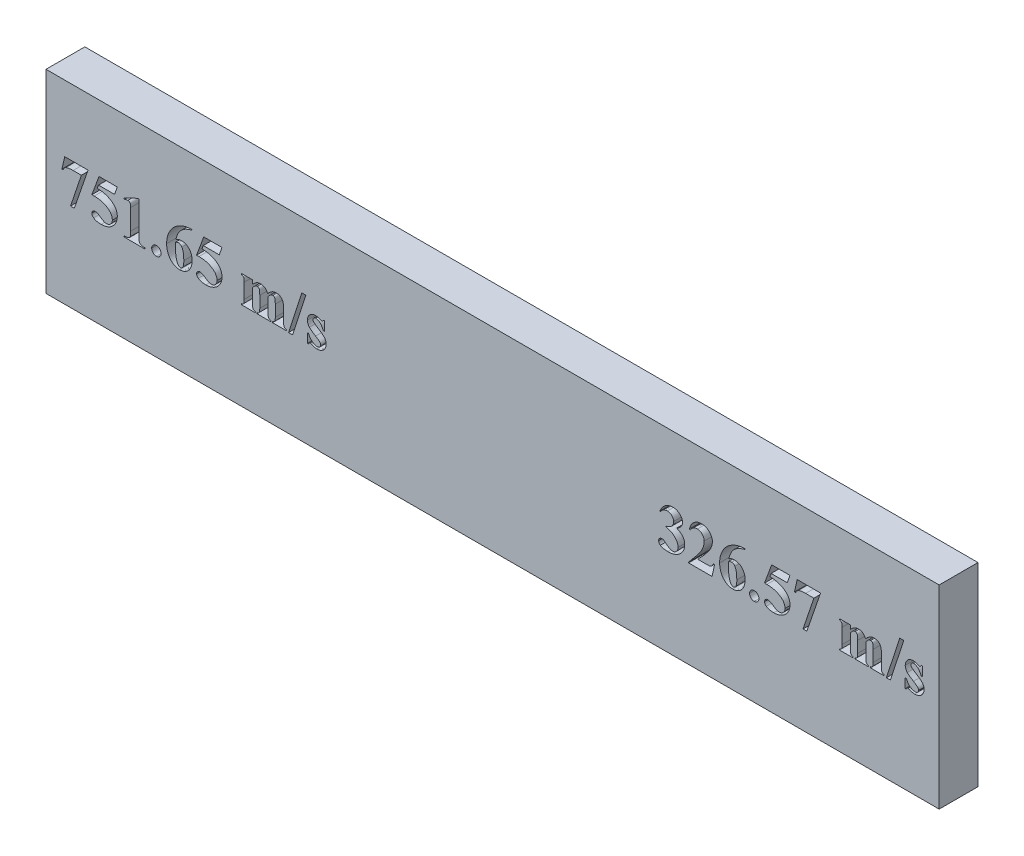
from build123d import *

# Parameters (mm, degrees)
CROQUIS1_W              = 230
CROQUIS1_H              = 50
SALIENTE_EXTRUIR1_DEPTH = 10
CORTAR_EXTRUIR1_DEPTH   = 5


with BuildPart() as part:
    # Croquis1 → Saliente-Extruir1 (new body)
    with BuildSketch(Plane.XY):
        Rectangle(CROQUIS1_W, CROQUIS1_H)
    extrude(amount=SALIENTE_EXTRUIR1_DEPTH)

    # Croquis3 → Cortar-Extruir1 (cut)
    # profile 1 of 18: a face of its own
    with BuildSketch(Plane.XY.offset(10)):
        with BuildLine():
            Line((-108.682514484, -2.350603768), (-105.893480912, 5.925089772))
            Line((-105.893480912, 5.925089772), (-108.020369823, 5.925089772))
            add(Edge.make_bspline(
                [(-108.020369823, 5.925089772), (-108.121462065, 5.924505275), (-108.317089687, 5.923374192), (-108.600407068, 5.907041143), (-108.863696348, 5.882933101), (-109.108035936, 5.850449204), (-109.332680469, 5.805640796), (-109.538760903, 5.753235772), (-109.725185588, 5.688807276), (-109.839963551, 5.636143099), (-109.895331641, 5.610738266)],
                knots=[0, 0, 0, 0, 1.265774339, 2.449450328, 3.552338031, 4.576269186, 5.53444199, 6.419261394, 7.237462702, 8, 8, 8, 8], degree=3))
            add(Edge.make_bspline(
                [(-109.895331641, 5.610738266), (-109.967187349, 5.568885263), (-110.115609464, 5.482435467), (-110.307435291, 5.292729854), (-110.480426616, 5.058018442), (-110.573372949, 4.878031323), (-110.622130157, 4.783614801)],
                knots=[0, 0, 0, 0, 0.887649326, 1.833490943, 2.863506174, 4, 4, 4, 4], degree=3))
            Line((-110.622130157, 4.783614801), (-110.905269457, 4.783614801))
            Line((-110.905269457, 4.783614801), (-110.176241497, 7.922670971))
            Line((-110.176241497, 7.922670971), (-104.174580126, 7.922670971))
            Line((-104.174580126, 7.922670971), (-107.708247761, -2.350603768))
            Line((-107.708247761, -2.350603768), (-108.682514484, -2.350603768))
        make_face()
    # profile 2 of 18: a face of its own
    with BuildSketch(Plane.XY.offset(10)):
        with BuildLine():
            Line((-101.345416574, 7.922670971), (-96.636832319, 7.922670971))
            Line((-96.636832319, 7.922670971), (-97.350254175, 5.925089772))
            Line((-97.350254175, 5.925089772), (-101.490330389, 5.925089772))
            Line((-101.490330389, 5.925089772), (-101.809140781, 5.068983544))
            add(Edge.make_bspline(
                [(-101.809140781, 5.068983544), (-101.597861706, 5.057550829), (-101.18679315, 5.035307124), (-100.589631947, 4.958184061), (-100.029461354, 4.851338858), (-99.506572702, 4.706276758), (-99.022124597, 4.525487219), (-98.573266554, 4.313924987), (-98.160750985, 4.067754749), (-97.915220794, 3.87092386), (-97.793913393, 3.773676985)],
                knots=[0, 0, 0, 0, 1.181358564, 2.298473512, 3.359898163, 4.363874666, 5.325217998, 6.244190373, 7.132519292, 8, 8, 8, 8], degree=3))
            add(Edge.make_bspline(
                [(-97.793913393, 3.773676985), (-97.701299201, 3.690927752), (-97.519824203, 3.528782872), (-97.285043357, 3.255878485), (-97.085414782, 2.969805514), (-96.920829471, 2.668822035), (-96.793126068, 2.352294296), (-96.701158521, 2.020419658), (-96.646889786, 1.67310663), (-96.640215249, 1.436667525), (-96.636832319, 1.316830465)],
                knots=[0, 0, 0, 0, 1.06066887, 2.078351901, 3.068684901, 4.03801469, 5.004112849, 5.979666994, 6.976012161, 8, 8, 8, 8], degree=3))
            add(Edge.make_bspline(
                [(-96.636832319, 1.316830465), (-96.642456651, 1.160226564), (-96.653762417, 0.845428833), (-96.758726281, 0.378232768), (-96.918690359, -0.084848327), (-97.108270888, -0.457529195), (-97.287711985, -0.74747109), (-97.438749601, -0.956261771), (-97.604663629, -1.153970867), (-97.785876823, -1.338541182), (-97.979397425, -1.513158113), (-98.189161663, -1.673937546), (-98.411197967, -1.826472418), (-98.649368235, -1.962737391), (-98.896081407, -2.087847488), (-99.149814862, -2.197052998), (-99.409584862, -2.289241585), (-99.675837577, -2.362379621), (-99.947602712, -2.420105457), (-100.225104169, -2.463210632), (-100.508933696, -2.487640991), (-100.700319651, -2.491393198), (-100.796973522, -2.49328814)],
                knots=[0, 0, 0, 0, 1.496600127, 3.008394553, 4.560131919, 6.175617455, 6.996454846, 7.821439846, 8.639036773, 9.463715258, 10.294593847, 11.130931618, 11.99084877, 12.870215168, 13.754284094, 14.636635491, 15.511505296, 16.389634548, 17.276644145, 18.168684486, 19.075147743, 20, 20, 20, 20], degree=3))
            add(Edge.make_bspline(
                [(-100.796973522, -2.49328814), (-100.898848271, -2.492508458), (-101.096973921, -2.490992135), (-101.38415404, -2.464855153), (-101.653896738, -2.428002163), (-101.90520335, -2.375145351), (-102.138871178, -2.306326913), (-102.353005308, -2.220688788), (-102.552435078, -2.124568827), (-102.671353506, -2.042979605), (-102.729900865, -2.002810613)],
                knots=[0, 0, 0, 0, 1.206287277, 2.345983209, 3.412879475, 4.429796151, 5.385104157, 6.293980255, 7.160071719, 8, 8, 8, 8], degree=3))
            add(Edge.make_bspline(
                [(-102.729900865, -2.002810613), (-102.801024428, -1.94614285), (-102.935389401, -1.839087435), (-103.085530991, -1.643155517), (-103.184301592, -1.434043097), (-103.195003908, -1.286690389), (-103.200313402, -1.213587684)],
                knots=[0, 0, 0, 0, 1.140499492, 2.154604994, 3.084486687, 4, 4, 4, 4], degree=3))
            add(Edge.make_bspline(
                [(-103.200313402, -1.213587684), (-103.197510334, -1.158215114), (-103.191987367, -1.049112932), (-103.141764083, -0.89200057), (-103.064857087, -0.744373886), (-102.959043257, -0.610443812), (-102.831653075, -0.498497569), (-102.691370544, -0.412916616), (-102.538688581, -0.361357082), (-102.433019809, -0.355811487), (-102.379878267, -0.353022569)],
                knots=[0, 0, 0, 0, 1.010043802, 1.990118642, 2.986912981, 4.041670408, 5.091162791, 6.072273303, 7.030533162, 8, 8, 8, 8], degree=3))
            add(Edge.make_bspline(
                [(-102.379878267, -0.353022569), (-102.280360567, -0.358485076), (-102.075773548, -0.369714819), (-101.851039311, -0.443633805), (-101.693958933, -0.510367133), (-101.598849483, -0.560544799), (-101.488649714, -0.621109392), (-101.364585314, -0.693710538), (-101.228751305, -0.782582772), (-101.077595962, -0.879086594), (-100.913772993, -0.989742124), (-100.800617253, -1.067827581), (-100.741237439, -1.108803848)],
                knots=[0, 0, 0, 0, 1.624372647, 3.339361329, 3.829361173, 4.416480839, 5.096531751, 5.886632758, 6.766703872, 7.751216244, 8.819924109, 10, 10, 10, 10], degree=3))
            add(Edge.make_bspline(
                [(-100.741237439, -1.108803848), (-100.667312188, -1.157720365), (-100.526417521, -1.250950706), (-100.320456515, -1.373787076), (-100.129260341, -1.472134946), (-100.004419188, -1.522116288), (-99.94532618, -1.545774736)],
                knots=[0, 0, 0, 0, 1.16876191, 2.227551728, 3.161019438, 4, 4, 4, 4], degree=3))
            add(Edge.make_bspline(
                [(-99.94532618, -1.545774736), (-99.8627783, -1.572693472), (-99.690447722, -1.628890209), (-99.509165237, -1.634341722), (-99.414718674, -1.637181911)],
                knots=[0, 0, 0, 0, 0.958017789, 2, 2, 2, 2], degree=3))
            add(Edge.make_bspline(
                [(-99.414718674, -1.637181911), (-99.314585419, -1.631470913), (-99.118206337, -1.620270631), (-98.835082479, -1.535672829), (-98.57894189, -1.390464996), (-98.350480623, -1.196967712), (-98.16068296, -0.964235135), (-98.021167961, -0.701645212), (-97.935082874, -0.416330251), (-97.9257379, -0.217623282), (-97.920991661, -0.116701579)],
                knots=[0, 0, 0, 0, 1.014383405, 1.989385848, 2.964184478, 3.980049899, 5.00852283, 5.989359579, 6.978811571, 8, 8, 8, 8], degree=3))
            add(Edge.make_bspline(
                [(-97.920991661, -0.116701579), (-97.924477119, -0.005655512), (-97.931319183, 0.212331448), (-97.996588698, 0.531206627), (-98.101208383, 0.833582068), (-98.248503256, 1.119575905), (-98.435381396, 1.390399331), (-98.667053859, 1.642176922), (-98.940302907, 1.876705105), (-99.248215483, 2.095828149), (-99.588118407, 2.292916466), (-99.953457194, 2.46413634), (-100.339470994, 2.612820151), (-100.749054561, 2.72861936), (-101.178164497, 2.824342516), (-101.630111248, 2.886280792), (-102.102630591, 2.928327651), (-102.425113031, 2.933016782), (-102.589445937, 2.935406303)],
                knots=[0, 0, 0, 0, 0.86044274, 1.689076445, 2.513065768, 3.335440532, 4.176491899, 5.057842219, 5.981314756, 6.964998487, 7.98529191, 9.024429862, 10.091755562, 11.189967696, 12.322879237, 13.499201517, 14.725625242, 16, 16, 16, 16], degree=3))
            add(Edge.make_bspline(
                [(-102.589445937, 2.935406303), (-102.628090931, 2.935563967), (-102.712818642, 2.935909638), (-102.853257956, 2.932713287), (-103.018241239, 2.930887309), (-103.13714589, 2.929470595), (-103.200313402, 2.928717973)],
                knots=[0, 0, 0, 0, 0.759066984, 1.664226103, 2.759131565, 4, 4, 4, 4], degree=3))
            Line((-103.200313402, 2.928717973), (-101.345416574, 7.922670971))
        make_face()
    # profile 3 of 18: a face of its own
    with BuildSketch(Plane.XY.offset(10)):
        with BuildLine():
            Line((-91.072141835, 8.065355343), (-91.072141835, -0.210338197))
            add(Edge.make_bspline(
                [(-91.072141835, -0.210338197), (-91.07131452, -0.287624699), (-91.069731479, -0.435510096), (-91.06879479, -0.645869645), (-91.062528893, -0.834742311), (-91.050346064, -1.001090599), (-91.039930972, -1.146118235), (-91.027757495, -1.269135786), (-91.009881979, -1.369548344), (-90.984628859, -1.473811703), (-90.934794853, -1.583618603), (-90.855845754, -1.702108909), (-90.751513761, -1.806834049), (-90.623140651, -1.901688079), (-90.459941979, -1.979091919), (-90.256508718, -2.029490271), (-90.014056079, -2.059460542), (-89.839361632, -2.063218538), (-89.745623069, -2.065235025)],
                knots=[0, 0, 0, 0, 1.355603789, 2.59390707, 3.68946524, 4.66918887, 5.518904925, 6.240030709, 6.835759485, 7.306792066, 8.118050392, 8.935047226, 9.792227987, 10.696851106, 11.722904844, 12.936961993, 14.356417237, 16, 16, 16, 16], degree=3))
            Line((-89.745623069, -2.065235025), (-89.502613749, -2.065235025))
            Line((-89.502613749, -2.065235025), (-89.502613749, -2.350603768))
            Line((-89.502613749, -2.350603768), (-94.924619862, -2.350603768))
            Line((-94.924619862, -2.350603768), (-94.924619862, -2.065235025))
            Line((-94.924619862, -2.065235025), (-94.648168892, -2.065235025))
            add(Edge.make_bspline(
                [(-94.648168892, -2.065235025), (-94.544726149, -2.064428803), (-94.352889398, -2.062933646), (-94.090020161, -2.029999207), (-93.872191488, -1.988821425), (-93.700695781, -1.917681669), (-93.566414162, -1.828631003), (-93.45532119, -1.729720695), (-93.37134323, -1.611470154), (-93.316869707, -1.500801848), (-93.284922158, -1.394587149), (-93.265667085, -1.291460912), (-93.251822131, -1.166107206), (-93.234855604, -1.019199557), (-93.224493981, -0.848821513), (-93.218619886, -0.65626141), (-93.213957415, -0.440733974), (-93.21294238, -0.289857633), (-93.212407405, -0.210338197)],
                knots=[0, 0, 0, 0, 1.747462186, 3.240705527, 4.475612815, 5.483832083, 6.355187765, 7.191212146, 7.982999373, 8.792342367, 9.265382691, 9.854400284, 10.563599026, 11.39763771, 12.354753919, 13.448686453, 14.655329177, 16, 16, 16, 16], degree=3))
            Line((-93.212407405, -0.210338197), (-93.212407405, 5.068983544))
            add(Edge.make_bspline(
                [(-93.212407405, 5.068983544), (-93.213274555, 5.16931725), (-93.21482326, 5.348510436), (-93.22476089, 5.58667929), (-93.24168124, 5.763014287), (-93.276691951, 5.917981159), (-93.365761697, 6.06174381), (-93.488484067, 6.167656264), (-93.602900809, 6.24323843), (-93.702539233, 6.278762582), (-93.806181358, 6.306303267), (-93.878068953, 6.307794513), (-93.914682046, 6.30855402)],
                knots=[0, 0, 0, 0, 1.840789511, 3.287598465, 4.371650065, 5.089217288, 6.183508897, 7.399611157, 8.042724791, 8.685838424, 9.330683965, 10, 10, 10, 10], degree=3))
            add(Edge.make_bspline(
                [(-93.914682046, 6.30855402), (-93.978810086, 6.305070862), (-94.114364331, 6.29770814), (-94.326577966, 6.249065374), (-94.557719064, 6.173272761), (-94.714867852, 6.104142559), (-94.797541594, 6.067774143)],
                knots=[0, 0, 0, 0, 0.835144304, 1.765333166, 2.824373563, 4, 4, 4, 4], degree=3))
            Line((-94.797541594, 6.067774143), (-94.924619862, 6.353142886))
            Line((-94.924619862, 6.353142886), (-91.310692268, 8.065355343))
            Line((-91.310692268, 8.065355343), (-91.072141835, 8.065355343))
        make_face()
    # profile 4 of 18: a face of its own
    with BuildSketch(Plane.XY.offset(10)):
        with BuildLine():
            add(Edge.make_bspline(
                [(-86.582043023, -0.067653826), (-86.499778989, -0.071625132), (-86.339043604, -0.079384651), (-86.108498969, -0.149959507), (-85.897323579, -0.262152207), (-85.714549305, -0.42049194), (-85.557945301, -0.603465739), (-85.44691908, -0.814644203), (-85.376682483, -1.043428069), (-85.368788988, -1.203412334), (-85.364766979, -1.284929869)],
                knots=[0, 0, 0, 0, 1.029416104, 2.011372252, 2.995449068, 4.007376866, 5.026446817, 5.997909019, 6.979865168, 8, 8, 8, 8], degree=3))
            add(Edge.make_bspline(
                [(-85.364766979, -1.284929869), (-85.368820346, -1.365687323), (-85.376775393, -1.52418009), (-85.446879303, -1.752059669), (-85.5607563, -1.96110723), (-85.71598221, -2.145870195), (-85.901480433, -2.299803551), (-86.111630417, -2.411275878), (-86.340574548, -2.481335924), (-86.500536737, -2.489253738), (-86.582043023, -2.49328814)],
                knots=[0, 0, 0, 0, 1.015231196, 1.992469982, 2.972573527, 3.996055976, 5.013571548, 5.989240111, 6.975448059, 8, 8, 8, 8], degree=3))
            add(Edge.make_bspline(
                [(-86.582043023, -2.49328814), (-86.662820921, -2.489278048), (-86.821353813, -2.481407933), (-87.048601252, -2.410790218), (-87.258078541, -2.299769693), (-87.443595523, -2.14648237), (-87.596882847, -1.960965388), (-87.707903371, -1.751488098), (-87.778521086, -1.524240659), (-87.786391201, -1.365707768), (-87.790401293, -1.284929869)],
                knots=[0, 0, 0, 0, 1.018885399, 1.999641638, 2.978822003, 4, 5.021177997, 6.000358362, 6.981114601, 8, 8, 8, 8], degree=3))
            add(Edge.make_bspline(
                [(-87.790401293, -1.284929869), (-87.786366892, -1.203423583), (-87.778449077, -1.043461395), (-87.708389031, -0.814517263), (-87.596916704, -0.60436728), (-87.442983348, -0.418869057), (-87.258220383, -0.263643147), (-87.049172823, -0.14976615), (-86.821293244, -0.079662239), (-86.662800476, -0.071707193), (-86.582043023, -0.067653826)],
                knots=[0, 0, 0, 0, 1.024551941, 2.010759889, 2.986428452, 4.003944024, 5.027426473, 6.007530018, 6.984768804, 8, 8, 8, 8], degree=3))
        make_face()
    # profile 5 of 18: a face of its own
    with BuildSketch(Plane.XY.offset(10)):
        with BuildLine():
            Line((-77.374442182, 8.065355343), (-77.374442182, 7.922670971))
            add(Edge.make_bspline(
                [(-77.374442182, 7.922670971), (-77.484595496, 7.892796977), (-77.69979569, 7.834433873), (-78.012448624, 7.738890917), (-78.307625139, 7.636070997), (-78.586586422, 7.526923815), (-78.849551138, 7.411699348), (-79.095694784, 7.288647505), (-79.324779149, 7.159781285), (-79.60603763, 6.982794542), (-79.926369232, 6.741119387), (-80.272459531, 6.422075964), (-80.573739185, 6.070544212), (-80.835548591, 5.687074271), (-81.059144187, 5.263967163), (-81.254948426, 4.798802446), (-81.428062437, 4.288132757), (-81.514476576, 3.926835895), (-81.559107261, 3.740235335)],
                knots=[0, 0, 0, 0, 0.867884167, 1.695535368, 2.485497193, 3.244238116, 3.972963391, 4.667974133, 5.335992886, 5.970972114, 7.193901179, 8.381536055, 9.543714822, 10.706772613, 11.90516886, 13.176296145, 14.541629411, 16, 16, 16, 16], degree=3))
            add(Edge.make_bspline(
                [(-81.559107261, 3.740235335), (-81.50664557, 3.777095841), (-81.408287074, 3.846204247), (-81.26575052, 3.936608005), (-81.13617326, 4.005248211), (-81.05185207, 4.037470107), (-81.012893652, 4.052357398)],
                knots=[0, 0, 0, 0, 1.218811647, 2.285105126, 3.20767732, 4, 4, 4, 4], degree=3))
            add(Edge.make_bspline(
                [(-81.012893652, 4.052357398), (-80.932311642, 4.077796588), (-80.772156135, 4.128356589), (-80.525902042, 4.174442669), (-80.27964859, 4.209094447), (-80.114554394, 4.21161566), (-80.031938599, 4.212877315)],
                knots=[0, 0, 0, 0, 1.014880846, 2.017060096, 3.007704929, 4, 4, 4, 4], degree=3))
            add(Edge.make_bspline(
                [(-80.031938599, 4.212877315), (-79.938914449, 4.210241345), (-79.756535088, 4.205073368), (-79.488231113, 4.166225359), (-79.231667178, 4.10215631), (-78.986761581, 4.010592774), (-78.755731384, 3.889874458), (-78.533652737, 3.748161862), (-78.326224593, 3.576295411), (-78.130293797, 3.383399887), (-77.951407898, 3.167928283), (-77.79803792, 2.929673826), (-77.664922414, 2.674316777), (-77.558394926, 2.398940979), (-77.476169218, 2.104580564), (-77.416260057, 1.792219932), (-77.379907885, 1.460378318), (-77.376296416, 1.232949311), (-77.374442182, 1.116180568)],
                knots=[0, 0, 0, 0, 0.974244488, 1.910064087, 2.83336554, 3.739974659, 4.641757788, 5.559495845, 6.494505561, 7.457864993, 8.436702072, 9.421342096, 10.420645309, 11.448529716, 12.508261407, 13.618244135, 14.77713647, 16, 16, 16, 16], degree=3))
            add(Edge.make_bspline(
                [(-77.374442182, 1.116180568), (-77.378558074, 0.95159577), (-77.386670742, 0.627189407), (-77.468880362, 0.151987498), (-77.594286081, -0.304571737), (-77.774968411, -0.73441181), (-77.998297346, -1.132257656), (-78.267269649, -1.486986765), (-78.583464193, -1.790789213), (-78.937307727, -2.04362794), (-79.317851326, -2.244387634), (-79.716096374, -2.38850061), (-80.128430555, -2.476373481), (-80.408292844, -2.48762458), (-80.549169445, -2.49328814)],
                knots=[0, 0, 0, 0, 1.102954922, 2.173989328, 3.224990376, 4.272901822, 5.293036352, 6.278029358, 7.24746204, 8.222669768, 9.185880162, 10.124053568, 11.055689285, 12, 12, 12, 12], degree=3))
            add(Edge.make_bspline(
                [(-80.549169445, -2.49328814), (-80.625754126, -2.491189861), (-80.777746758, -2.487025545), (-81.003787094, -2.465400137), (-81.224968254, -2.424630227), (-81.442281465, -2.368191391), (-81.656402204, -2.298443733), (-81.863992256, -2.206432432), (-82.070012733, -2.105987919), (-82.268071348, -1.984270895), (-82.459146246, -1.849225978), (-82.640826082, -1.699301657), (-82.810893136, -1.533807752), (-82.968554149, -1.351989381), (-83.119203985, -1.158121013), (-83.256609979, -0.948010137), (-83.384616991, -0.724218858), (-83.538347941, -0.405244359), (-83.701168185, 0.014238607), (-83.834845054, 0.54304127), (-83.924608722, 1.091570444), (-83.933442061, 1.46583782), (-83.937923265, 1.655705847)],
                knots=[0, 0, 0, 0, 0.768161024, 1.524519176, 2.274388028, 3.020879493, 3.774994836, 4.529441504, 5.295974108, 6.071760818, 6.857505773, 7.640879383, 8.431380814, 9.234082599, 10.052406881, 10.891572003, 11.749358782, 12.635926782, 14.440619616, 16.249937884, 18.097571573, 20, 20, 20, 20], degree=3))
            add(Edge.make_bspline(
                [(-83.937923265, 1.655705847), (-83.935241139, 1.7962493), (-83.929909793, 2.075611922), (-83.890519246, 2.491004532), (-83.829173978, 2.900091344), (-83.739189761, 3.301218307), (-83.625754906, 3.695533404), (-83.484339079, 4.081552838), (-83.318898486, 4.461126702), (-83.130728723, 4.83287953), (-82.916523301, 5.190344765), (-82.683248967, 5.53297248), (-82.425069502, 5.853990489), (-82.149008048, 6.158795371), (-81.848437375, 6.442291965), (-81.527705139, 6.707810079), (-81.184947396, 6.952971721), (-80.824220016, 7.181238335), (-80.444279756, 7.385326631), (-80.048210357, 7.564649949), (-79.637506685, 7.716013798), (-79.212915259, 7.840752821), (-78.774528078, 7.940111916), (-78.320513615, 8.007054028), (-77.852482801, 8.053699724), (-77.535076686, 8.061438741), (-77.374442182, 8.065355343)],
                knots=[0, 0, 0, 0, 0.987834349, 1.963549278, 2.930667679, 3.893926611, 4.851174752, 5.81298771, 6.781558252, 7.760470446, 8.739703187, 9.709090482, 10.671796798, 11.633240827, 12.597703081, 13.573585812, 14.557988537, 15.558054682, 16.572440243, 17.587148591, 18.61190612, 19.646681171, 20.696069232, 21.768836185, 22.870841253, 24, 24, 24, 24], degree=3))
        make_face()
        with BuildLine():
            add(Edge.make_bspline(
                [(-81.654973323, 3.113761767), (-81.654973323, 2.95621444), (-81.654973323, 2.664157368), (-81.654973323, 2.259884982), (-81.654973323, 1.923982191), (-81.654973323, 1.722589146), (-81.654973323, 1.633411414)],
                knots=[0, 0, 0, 0, 1.277108434, 2.36746988, 3.277108434, 4, 4, 4, 4], degree=3))
            add(Edge.make_bspline(
                [(-81.654973323, 1.633411414), (-81.653349699, 1.46611293), (-81.650126997, 1.134045385), (-81.608440437, 0.64036642), (-81.553143506, 0.154026257), (-81.483144591, -0.242613631), (-81.413792543, -0.5460828), (-81.362383415, -0.756832843), (-81.300006009, -0.948337328), (-81.240793801, -1.125042179), (-81.169095607, -1.28118818), (-81.100565018, -1.422886528), (-81.021176837, -1.543885953), (-80.964331221, -1.616002552), (-80.93709258, -1.650558571)],
                knots=[0, 0, 0, 0, 1.765252849, 3.503816432, 5.22584644, 6.930641353, 7.750779231, 8.511732795, 9.218748207, 9.876164345, 10.47665058, 11.030890725, 11.535633152, 12, 12, 12, 12], degree=3))
            add(Edge.make_bspline(
                [(-80.93709258, -1.650558571), (-80.897136257, -1.691967979), (-80.819496082, -1.772431684), (-80.678669657, -1.856471731), (-80.528779579, -1.912750715), (-80.424090567, -1.919245458), (-80.370813981, -1.922550654)],
                knots=[0, 0, 0, 0, 1.062691201, 2.064943078, 3.01524311, 4, 4, 4, 4], degree=3))
            add(Edge.make_bspline(
                [(-80.370813981, -1.922550654), (-80.315752753, -1.917733392), (-80.203645477, -1.907925218), (-80.044356399, -1.827415639), (-79.900665885, -1.698126953), (-79.787546891, -1.558990908), (-79.710155745, -1.413926657), (-79.656999777, -1.277083198), (-79.61359087, -1.114638301), (-79.575862935, -0.92782243), (-79.547713545, -0.715537965), (-79.527950767, -0.478202196), (-79.517643163, -0.215631319), (-79.515714603, -0.031990604), (-79.514707753, 0.063883329)],
                knots=[0, 0, 0, 0, 0.831725034, 1.693431706, 2.64415036, 3.750889271, 4.391089087, 5.129612383, 5.971500204, 6.937056106, 8.017329729, 9.215854958, 10.546471933, 12, 12, 12, 12], degree=3))
            add(Edge.make_bspline(
                [(-79.514707753, 0.063883329), (-79.515402268, 0.225937107), (-79.516738038, 0.537616856), (-79.54315876, 0.985146162), (-79.577798826, 1.394093495), (-79.635142951, 1.762753669), (-79.700591647, 2.094040962), (-79.789477498, 2.384484859), (-79.88485726, 2.640409074), (-79.972652753, 2.787792592), (-80.014103052, 2.857375787)],
                knots=[0, 0, 0, 0, 1.354856513, 2.605809899, 3.747932318, 4.785002842, 5.724685677, 6.568121984, 7.323976998, 8, 8, 8, 8], degree=3))
            add(Edge.make_bspline(
                [(-80.014103052, 2.857375787), (-80.041474911, 2.897428578), (-80.094117081, 2.974459), (-80.185579865, 3.076746138), (-80.282510058, 3.164480886), (-80.389620976, 3.233439964), (-80.500749195, 3.291155516), (-80.621765042, 3.327792724), (-80.747920436, 3.354225219), (-80.835137219, 3.35591753), (-80.879127054, 3.356771087)],
                knots=[0, 0, 0, 0, 1.111908886, 2.138448031, 3.140917603, 4.10087319, 5.053990859, 6.002982127, 6.992757081, 8, 8, 8, 8], degree=3))
            add(Edge.make_bspline(
                [(-80.879127054, 3.356771087), (-80.932865172, 3.353132665), (-81.049303507, 3.345249028), (-81.233302306, 3.296628336), (-81.439169475, 3.220171211), (-81.579781902, 3.15083746), (-81.654973323, 3.113761767)],
                knots=[0, 0, 0, 0, 0.787251429, 1.7057956, 2.773191735, 4, 4, 4, 4], degree=3))
        make_face(mode=Mode.SUBTRACT)
    # profile 6 of 18: a face of its own
    with BuildSketch(Plane.XY.offset(10)):
        with BuildLine():
            Line((-74.378070383, 7.922670971), (-69.669486127, 7.922670971))
            Line((-69.669486127, 7.922670971), (-70.382907984, 5.925089772))
            Line((-70.382907984, 5.925089772), (-74.522984197, 5.925089772))
            Line((-74.522984197, 5.925089772), (-74.84179459, 5.068983544))
            add(Edge.make_bspline(
                [(-74.84179459, 5.068983544), (-74.630515514, 5.057550829), (-74.219446958, 5.035307124), (-73.622285756, 4.958184061), (-73.062115163, 4.851338858), (-72.539226511, 4.706276758), (-72.054778405, 4.525487219), (-71.605920362, 4.313924987), (-71.193404794, 4.067754749), (-70.947874603, 3.87092386), (-70.826567201, 3.773676985)],
                knots=[0, 0, 0, 0, 1.181358564, 2.298473512, 3.359898163, 4.363874666, 5.325217998, 6.244190373, 7.132519292, 8, 8, 8, 8], degree=3))
            add(Edge.make_bspline(
                [(-70.826567201, 3.773676985), (-70.73395301, 3.690927752), (-70.552478012, 3.528782872), (-70.317697166, 3.255878485), (-70.11806859, 2.969805514), (-69.95348328, 2.668822035), (-69.825779876, 2.352294296), (-69.73381233, 2.020419658), (-69.679543595, 1.67310663), (-69.672869057, 1.436667525), (-69.669486127, 1.316830465)],
                knots=[0, 0, 0, 0, 1.06066887, 2.078351901, 3.068684901, 4.03801469, 5.004112849, 5.979666994, 6.976012161, 8, 8, 8, 8], degree=3))
            add(Edge.make_bspline(
                [(-69.669486127, 1.316830465), (-69.675110459, 1.160226564), (-69.686416225, 0.845428833), (-69.791380089, 0.378232768), (-69.951344168, -0.084848327), (-70.140924696, -0.457529195), (-70.320365794, -0.74747109), (-70.47140341, -0.956261771), (-70.637317438, -1.153970867), (-70.818530632, -1.338541182), (-71.012051233, -1.513158113), (-71.221815471, -1.673937546), (-71.443851776, -1.826472418), (-71.682022044, -1.962737391), (-71.928735216, -2.087847488), (-72.182468671, -2.197052998), (-72.44223867, -2.289241585), (-72.708491386, -2.362379621), (-72.980256521, -2.420105457), (-73.257757978, -2.463210632), (-73.541587505, -2.487640991), (-73.73297346, -2.491393198), (-73.82962733, -2.49328814)],
                knots=[0, 0, 0, 0, 1.496600127, 3.008394553, 4.560131919, 6.175617455, 6.996454846, 7.821439846, 8.639036773, 9.463715258, 10.294593847, 11.130931618, 11.99084877, 12.870215168, 13.754284094, 14.636635491, 15.511505296, 16.389634548, 17.276644145, 18.168684486, 19.075147743, 20, 20, 20, 20], degree=3))
            add(Edge.make_bspline(
                [(-73.82962733, -2.49328814), (-73.93150208, -2.492508458), (-74.12962773, -2.490992135), (-74.416807848, -2.464855153), (-74.686550547, -2.428002163), (-74.937857159, -2.375145351), (-75.171524987, -2.306326913), (-75.385659116, -2.220688788), (-75.585088887, -2.124568827), (-75.704007315, -2.042979605), (-75.762554674, -2.002810613)],
                knots=[0, 0, 0, 0, 1.206287277, 2.345983209, 3.412879475, 4.429796151, 5.385104157, 6.293980255, 7.160071719, 8, 8, 8, 8], degree=3))
            add(Edge.make_bspline(
                [(-75.762554674, -2.002810613), (-75.833678237, -1.94614285), (-75.96804321, -1.839087435), (-76.1181848, -1.643155517), (-76.2169554, -1.434043097), (-76.227657717, -1.286690389), (-76.232967211, -1.213587684)],
                knots=[0, 0, 0, 0, 1.140499492, 2.154604994, 3.084486687, 4, 4, 4, 4], degree=3))
            add(Edge.make_bspline(
                [(-76.232967211, -1.213587684), (-76.230164142, -1.158215114), (-76.224641175, -1.049112932), (-76.174417892, -0.89200057), (-76.097510895, -0.744373886), (-75.991697066, -0.610443812), (-75.864306884, -0.498497569), (-75.724024353, -0.412916616), (-75.57134239, -0.361357082), (-75.465673618, -0.355811487), (-75.412532075, -0.353022569)],
                knots=[0, 0, 0, 0, 1.010043802, 1.990118642, 2.986912981, 4.041670408, 5.091162791, 6.072273303, 7.030533162, 8, 8, 8, 8], degree=3))
            add(Edge.make_bspline(
                [(-75.412532075, -0.353022569), (-75.313014376, -0.358485076), (-75.108427356, -0.369714819), (-74.883693119, -0.443633805), (-74.726612742, -0.510367133), (-74.631503291, -0.560544799), (-74.521303522, -0.621109392), (-74.397239122, -0.693710538), (-74.261405114, -0.782582772), (-74.110249771, -0.879086594), (-73.946426802, -0.989742124), (-73.833271062, -1.067827581), (-73.773891248, -1.108803848)],
                knots=[0, 0, 0, 0, 1.624372647, 3.339361329, 3.829361173, 4.416480839, 5.096531751, 5.886632758, 6.766703872, 7.751216244, 8.819924109, 10, 10, 10, 10], degree=3))
            add(Edge.make_bspline(
                [(-73.773891248, -1.108803848), (-73.699965997, -1.157720365), (-73.559071329, -1.250950706), (-73.353110324, -1.373787076), (-73.16191415, -1.472134946), (-73.037072997, -1.522116288), (-72.977979989, -1.545774736)],
                knots=[0, 0, 0, 0, 1.16876191, 2.227551728, 3.161019438, 4, 4, 4, 4], degree=3))
            add(Edge.make_bspline(
                [(-72.977979989, -1.545774736), (-72.895432109, -1.572693472), (-72.723101531, -1.628890209), (-72.541819045, -1.634341722), (-72.447372483, -1.637181911)],
                knots=[0, 0, 0, 0, 0.958017789, 2, 2, 2, 2], degree=3))
            add(Edge.make_bspline(
                [(-72.447372483, -1.637181911), (-72.347239227, -1.631470913), (-72.150860146, -1.620270631), (-71.867736288, -1.535672829), (-71.611595698, -1.390464996), (-71.383134431, -1.196967712), (-71.193336769, -0.964235135), (-71.05382177, -0.701645212), (-70.967736683, -0.416330251), (-70.958391708, -0.217623282), (-70.95364547, -0.116701579)],
                knots=[0, 0, 0, 0, 1.014383405, 1.989385848, 2.964184478, 3.980049899, 5.00852283, 5.989359579, 6.978811571, 8, 8, 8, 8], degree=3))
            add(Edge.make_bspline(
                [(-70.95364547, -0.116701579), (-70.957130927, -0.005655512), (-70.963972992, 0.212331448), (-71.029242506, 0.531206627), (-71.133862192, 0.833582068), (-71.281157064, 1.119575905), (-71.468035204, 1.390399331), (-71.699707668, 1.642176922), (-71.972956716, 1.876705105), (-72.280869291, 2.095828149), (-72.620772215, 2.292916466), (-72.986111002, 2.46413634), (-73.372124803, 2.612820151), (-73.781708369, 2.72861936), (-74.210818306, 2.824342516), (-74.662765057, 2.886280792), (-75.1352844, 2.928327651), (-75.45776684, 2.933016782), (-75.622099746, 2.935406303)],
                knots=[0, 0, 0, 0, 0.86044274, 1.689076445, 2.513065768, 3.335440532, 4.176491899, 5.057842219, 5.981314756, 6.964998487, 7.98529191, 9.024429862, 10.091755562, 11.189967696, 12.322879237, 13.499201517, 14.725625242, 16, 16, 16, 16], degree=3))
            add(Edge.make_bspline(
                [(-75.622099746, 2.935406303), (-75.66074474, 2.935563967), (-75.745472451, 2.935909638), (-75.885911765, 2.932713287), (-76.050895048, 2.930887309), (-76.169799698, 2.929470595), (-76.232967211, 2.928717973)],
                knots=[0, 0, 0, 0, 0.759066984, 1.664226103, 2.759131565, 4, 4, 4, 4], degree=3))
            Line((-76.232967211, 2.928717973), (-74.378070383, 7.922670971))
        make_face()
    # profile 7 of 18: a face of its own
    with BuildSketch(Plane.XY.offset(10)):
        with BuildLine():
            Line((-61.808469041, 4.64093043), (-61.808469041, 3.637680943))
            add(Edge.make_bspline(
                [(-61.808469041, 3.637680943), (-61.717614626, 3.737019292), (-61.545123687, 3.925617338), (-61.280171768, 4.174451728), (-61.025374846, 4.375027272), (-60.777730362, 4.532628655), (-60.526381795, 4.645793198), (-60.268448872, 4.727131405), (-59.998442138, 4.774823759), (-59.814789833, 4.780657905), (-59.72171011, 4.783614801)],
                knots=[0, 0, 0, 0, 1.310839921, 2.488684881, 3.5354818, 4.465348085, 5.339907189, 6.212096983, 7.093844651, 8, 8, 8, 8], degree=3))
            add(Edge.make_bspline(
                [(-59.72171011, 4.783614801), (-59.616570903, 4.780175695), (-59.413355733, 4.773528522), (-59.122243966, 4.710607077), (-58.854977347, 4.614957498), (-58.617811491, 4.470045463), (-58.404128824, 4.289269632), (-58.218117434, 4.064927659), (-58.058308228, 3.798312446), (-57.977826628, 3.600310475), (-57.935926024, 3.497226015)],
                knots=[0, 0, 0, 0, 1.064941301, 2.058339924, 3.007578188, 3.930537164, 4.860914509, 5.834674245, 6.872680733, 8, 8, 8, 8], degree=3))
            add(Edge.make_bspline(
                [(-57.935926024, 3.497226015), (-57.840758291, 3.604102449), (-57.658878933, 3.808358836), (-57.375957082, 4.079538166), (-57.098026398, 4.30214358), (-56.825605005, 4.482873388), (-56.550756465, 4.619130836), (-56.27073937, 4.712553565), (-55.985671544, 4.774673136), (-55.792265959, 4.780629572), (-55.695335505, 4.783614801)],
                knots=[0, 0, 0, 0, 1.285751535, 2.45725791, 3.516957821, 4.482045906, 5.390031353, 6.264383371, 7.130148654, 8, 8, 8, 8], degree=3))
            add(Edge.make_bspline(
                [(-55.695335505, 4.783614801), (-55.58278538, 4.780373899), (-55.367651492, 4.774179079), (-55.063562312, 4.710932445), (-54.794684516, 4.608991226), (-54.564651642, 4.463462326), (-54.370258912, 4.287485951), (-54.205623123, 4.090499254), (-54.074202651, 3.870042788), (-53.992247874, 3.668157543), (-53.942243323, 3.489411508), (-53.909530113, 3.335927189), (-53.880708956, 3.163338034), (-53.856229517, 2.97227756), (-53.838502609, 2.762513189), (-53.829085683, 2.534148516), (-53.818449932, 2.287473443), (-53.818248455, 2.116471565), (-53.818144244, 2.028022879)],
                knots=[0, 0, 0, 0, 1.406057925, 2.687608817, 3.864830911, 4.984114724, 6.070215858, 7.132997031, 8.183513047, 9.267504047, 9.847166531, 10.5035118, 11.229366899, 12.035261965, 12.912164298, 13.861407631, 14.893838555, 16, 16, 16, 16], degree=3))
            Line((-53.818144244, 2.028022879), (-53.818144244, -0.781075683))
            add(Edge.make_bspline(
                [(-53.818144244, -0.781075683), (-53.817780446, -0.84648142), (-53.817089841, -0.9706422), (-53.810256698, -1.147566148), (-53.800048007, -1.305335983), (-53.783426678, -1.443382849), (-53.768268476, -1.562578132), (-53.741939279, -1.660880654), (-53.718123794, -1.74271438), (-53.67223619, -1.824506072), (-53.592211077, -1.90838732), (-53.459254915, -1.975437824), (-53.296240466, -2.036539031), (-53.172258604, -2.055115777), (-53.104722387, -2.065235025)],
                knots=[0, 0, 0, 0, 1.392278969, 2.642985912, 3.769011202, 4.756103479, 5.604079096, 6.321596927, 6.921936259, 7.410577074, 8.305789735, 9.339936073, 10.550992447, 12, 12, 12, 12], degree=3))
            Line((-53.104722387, -2.065235025), (-53.104722387, -2.350603768))
            Line((-53.104722387, -2.350603768), (-56.671831671, -2.350603768))
            Line((-56.671831671, -2.350603768), (-56.671831671, -2.065235025))
            add(Edge.make_bspline(
                [(-56.671831671, -2.065235025), (-56.608738987, -2.056030615), (-56.488094951, -2.038430203), (-56.322805856, -1.969779765), (-56.182668324, -1.86758399), (-56.116661466, -1.775293014), (-56.08325864, -1.728589087)],
                knots=[0, 0, 0, 0, 1.084646906, 2.074030929, 3.02536172, 4, 4, 4, 4], degree=3))
            add(Edge.make_bspline(
                [(-56.08325864, -1.728589087), (-56.073202485, -1.708707791), (-56.051046886, -1.664905558), (-56.023976911, -1.588190671), (-56.006344127, -1.494073967), (-55.987271269, -1.384289991), (-55.975644205, -1.256799965), (-55.963007382, -1.112752214), (-55.960457725, -0.951998313), (-55.95911316, -0.839778275), (-55.958409815, -0.781075683)],
                knots=[0, 0, 0, 0, 0.554725495, 1.222164579, 2.017294585, 2.936364225, 3.997345319, 5.204142878, 6.537479911, 8, 8, 8, 8], degree=3))
            Line((-55.958409815, -0.781075683), (-55.958409815, 2.141724487))
            add(Edge.make_bspline(
                [(-55.958409815, 2.141724487), (-55.957914887, 2.213816633), (-55.956970837, 2.351328851), (-55.963333094, 2.547467991), (-55.965564457, 2.723738615), (-55.975926056, 2.878959117), (-55.984026585, 3.01281879), (-55.994127099, 3.126147673), (-56.010161545, 3.218117356), (-56.029518725, 3.313169827), (-56.064775555, 3.409689297), (-56.111827089, 3.511997073), (-56.17428085, 3.595664382), (-56.243117342, 3.666180679), (-56.32217915, 3.720141582), (-56.407578636, 3.758134606), (-56.499619889, 3.781978445), (-56.563180844, 3.783854575), (-56.596030599, 3.784824201)],
                knots=[0, 0, 0, 0, 1.755570193, 3.348663709, 4.77891611, 6.047889167, 7.136219354, 8.045665853, 8.816294885, 9.409146933, 10.405066809, 11.311627314, 12.14061715, 12.934073712, 13.702148165, 14.455583087, 15.201810028, 16, 16, 16, 16], degree=3))
            add(Edge.make_bspline(
                [(-56.596030599, 3.784824201), (-56.646189212, 3.782572704), (-56.748484849, 3.777980904), (-56.899716801, 3.728241283), (-57.053322152, 3.65744662), (-57.205042422, 3.552198676), (-57.356188966, 3.418713726), (-57.511447339, 3.259852052), (-57.664435228, 3.068771961), (-57.762131576, 2.928580893), (-57.813306643, 2.855146344)],
                knots=[0, 0, 0, 0, 0.754352967, 1.538459965, 2.381236926, 3.301888414, 4.311470929, 5.421725731, 6.649454542, 8, 8, 8, 8], degree=3))
            Line((-57.813306643, 2.855146344), (-57.813306643, -0.781075683))
            add(Edge.make_bspline(
                [(-57.813306643, -0.781075683), (-57.812693285, -0.842015242), (-57.811518771, -0.958707872), (-57.807820791, -1.12451321), (-57.799196708, -1.273290863), (-57.785557814, -1.403306175), (-57.771090858, -1.515989759), (-57.750849725, -1.610571889), (-57.728294486, -1.688156754), (-57.706798647, -1.731766477), (-57.697375591, -1.75088352)],
                knots=[0, 0, 0, 0, 1.486887888, 2.847228626, 4.046098801, 5.12137062, 6.036783454, 6.815591205, 7.480794833, 8, 8, 8, 8], degree=3))
            add(Edge.make_bspline(
                [(-57.697375591, -1.75088352), (-57.667757011, -1.794638171), (-57.60751208, -1.883636225), (-57.468512056, -1.980909922), (-57.295612151, -2.043552097), (-57.168094145, -2.057678705), (-57.099884786, -2.065235025)],
                knots=[0, 0, 0, 0, 0.894469205, 1.819372692, 2.833582831, 4, 4, 4, 4], degree=3))
            Line((-57.099884786, -2.065235025), (-57.099884786, -2.350603768))
            Line((-57.099884786, -2.350603768), (-60.66699407, -2.350603768))
            Line((-60.66699407, -2.350603768), (-60.66699407, -2.065235025))
            add(Edge.make_bspline(
                [(-60.66699407, -2.065235025), (-60.622251357, -2.061140723), (-60.537088512, -2.053347667), (-60.417174523, -2.024862934), (-60.311976522, -1.979879568), (-60.196076339, -1.900478629), (-60.080025167, -1.777250276), (-60.007496408, -1.618346032), (-59.977257089, -1.456912856), (-59.965384469, -1.279895291), (-59.952876449, -1.04877839), (-59.953324911, -0.876227957), (-59.953572213, -0.781075683)],
                knots=[0, 0, 0, 0, 0.799330819, 1.521438514, 2.185173858, 2.823767176, 4.012993921, 5.149751366, 5.87897716, 6.928434885, 8.30619719, 10, 10, 10, 10], degree=3))
            Line((-59.953572213, -0.781075683), (-59.953572213, 2.137265601))
            add(Edge.make_bspline(
                [(-59.953572213, 2.137265601), (-59.953079135, 2.21010077), (-59.952138149, 2.349098864), (-59.958463248, 2.546725884), (-59.96074266, 2.723736964), (-59.971052002, 2.878963917), (-59.979293701, 3.01280473), (-59.988863838, 3.124726757), (-60.005453016, 3.214413333), (-60.024812612, 3.305697567), (-60.058665238, 3.400144661), (-60.113801748, 3.49754956), (-60.178018116, 3.583527792), (-60.254655278, 3.654113969), (-60.336113441, 3.713329256), (-60.424392604, 3.753081333), (-60.514654767, 3.779242536), (-60.576156298, 3.782968006), (-60.606799101, 3.784824201)],
                knots=[0, 0, 0, 0, 1.768423567, 3.374846346, 4.800869049, 6.06608936, 7.151201018, 8.057958002, 8.790732837, 9.364216308, 10.323158803, 11.211778815, 12.074366633, 12.91690263, 13.732934038, 14.508035228, 15.25663666, 16, 16, 16, 16], degree=3))
            add(Edge.make_bspline(
                [(-60.606799101, 3.784824201), (-60.652308671, 3.783369836), (-60.742068213, 3.780501359), (-60.873513114, 3.749641968), (-60.998800432, 3.70168346), (-61.074883383, 3.654538826), (-61.112882731, 3.630992613)],
                knots=[0, 0, 0, 0, 1.015592554, 2.003075895, 3.002643666, 4, 4, 4, 4], degree=3))
            add(Edge.make_bspline(
                [(-61.112882731, 3.630992613), (-61.16991253, 3.587860816), (-61.291606097, 3.495823629), (-61.459052077, 3.315629362), (-61.638617036, 3.103613711), (-61.74976945, 2.941014821), (-61.808469041, 2.855146344)],
                knots=[0, 0, 0, 0, 0.81783629, 1.745147553, 2.809212387, 4, 4, 4, 4], degree=3))
            Line((-61.808469041, 2.855146344), (-61.808469041, -0.781075683))
            add(Edge.make_bspline(
                [(-61.808469041, -0.781075683), (-61.808094641, -0.841279583), (-61.80737794, -0.956525563), (-61.800540647, -1.121563779), (-61.790347972, -1.270417543), (-61.773365505, -1.403228045), (-61.75824863, -1.520850206), (-61.732543815, -1.620859585), (-61.70691832, -1.706228815), (-61.66278823, -1.797389692), (-61.586351849, -1.896508535), (-61.452080327, -1.976728704), (-61.286959251, -2.039153587), (-61.162593064, -2.056055333), (-61.095047184, -2.065235025)],
                knots=[0, 0, 0, 0, 1.289535939, 2.46850838, 3.538046122, 4.483853484, 5.337116949, 6.074562901, 6.693768396, 7.241991938, 8.238932192, 9.320720546, 10.544827251, 12, 12, 12, 12], degree=3))
            Line((-61.095047184, -2.065235025), (-61.095047184, -2.350603768))
            Line((-61.095047184, -2.350603768), (-64.662156469, -2.350603768))
            Line((-64.662156469, -2.350603768), (-64.662156469, -2.065235025))
            add(Edge.make_bspline(
                [(-64.662156469, -2.065235025), (-64.596919942, -2.055729384), (-64.474283229, -2.037859939), (-64.308085703, -1.976278505), (-64.168081295, -1.892913328), (-64.101497991, -1.813849154), (-64.06912455, -1.775407396)],
                knots=[0, 0, 0, 0, 1.161939667, 2.184304822, 3.117191614, 4, 4, 4, 4], degree=3))
            add(Edge.make_bspline(
                [(-64.06912455, -1.775407396), (-64.058852204, -1.757859131), (-64.035844994, -1.718555882), (-64.012338816, -1.644276032), (-63.99370725, -1.549995998), (-63.974950561, -1.435608749), (-63.966775275, -1.300509168), (-63.952889308, -1.146208113), (-63.950886299, -0.97056778), (-63.949477096, -0.846463852), (-63.948734612, -0.781075683)],
                knots=[0, 0, 0, 0, 0.481900215, 1.079322925, 1.837685983, 2.766571147, 3.829570474, 5.050991329, 6.446219399, 8, 8, 8, 8], degree=3))
            Line((-63.948734612, -0.781075683), (-63.948734612, 3.071402344))
            add(Edge.make_bspline(
                [(-63.948734612, 3.071402344), (-63.949149627, 3.136802059), (-63.949937458, 3.260951406), (-63.956093767, 3.437210806), (-63.96829123, 3.593920742), (-63.979239482, 3.731234115), (-64.000141473, 3.84951348), (-64.023892478, 3.947794237), (-64.049346546, 4.029089845), (-64.094428969, 4.110598922), (-64.175635962, 4.192785303), (-64.304285312, 4.268716542), (-64.471189382, 4.322348174), (-64.594931299, 4.343869703), (-64.662156469, 4.355561687)],
                knots=[0, 0, 0, 0, 1.394039664, 2.646328268, 3.757976898, 4.744665889, 5.580609571, 6.314412226, 6.900504699, 7.389763455, 8.286108214, 9.323861881, 10.546136616, 12, 12, 12, 12], degree=3))
            Line((-64.662156469, 4.355561687), (-64.662156469, 4.64093043))
            Line((-64.662156469, 4.64093043), (-61.808469041, 4.64093043))
        make_face()
    # profile 8 of 18: a face of its own
    with BuildSketch(Plane.XY.offset(10)):
        Polygon((-48.081786626, 8.065355343), (-51.506211539, -2.49328814), (-52.547361561, -2.49328814), (-49.122936648, 8.065355343), align=None)
    # profile 9 of 18: a face of its own
    with BuildSketch(Plane.XY.offset(10)):
        with BuildLine():
            Line((-43.272877421, 4.783614801), (-43.272877421, 2.357980488))
            Line((-43.272877421, 2.357980488), (-43.558246164, 2.357980488))
            add(Edge.make_bspline(
                [(-43.558246164, 2.357980488), (-43.596168946, 2.443779073), (-43.669701303, 2.610142721), (-43.787957873, 2.845555389), (-43.905923521, 3.061126582), (-44.025863645, 3.254544811), (-44.14643137, 3.427848339), (-44.268447959, 3.579241159), (-44.391546246, 3.710504069), (-44.554461383, 3.852308129), (-44.760137985, 3.993174181), (-45.010506729, 4.11966589), (-45.262849673, 4.197792298), (-45.432708566, 4.207926162), (-45.515697384, 4.212877315)],
                knots=[0, 0, 0, 0, 1.182551389, 2.292969761, 3.320437771, 4.279860458, 5.161060857, 5.980521494, 6.72945319, 7.42666226, 8.700149159, 9.86085819, 10.954868674, 12, 12, 12, 12], degree=3))
            add(Edge.make_bspline(
                [(-45.515697384, 4.212877315), (-45.565732442, 4.210219948), (-45.664303943, 4.204984803), (-45.805907014, 4.166213583), (-45.93664437, 4.102687279), (-46.050109201, 4.013757574), (-46.145592961, 3.910693561), (-46.216937083, 3.796953081), (-46.262177326, 3.674412678), (-46.266890964, 3.589004092), (-46.26924922, 3.546273768)],
                knots=[0, 0, 0, 0, 1.079041566, 2.125764432, 3.144456662, 4.196818315, 5.218663032, 6.162353748, 7.080616787, 8, 8, 8, 8], degree=3))
            add(Edge.make_bspline(
                [(-46.26924922, 3.546273768), (-46.267946029, 3.513263937), (-46.265308962, 3.446467075), (-46.230008527, 3.350419463), (-46.183920071, 3.253084025), (-46.137582353, 3.195404134), (-46.113188189, 3.165038963)],
                knots=[0, 0, 0, 0, 0.937228609, 1.896523842, 2.892639868, 4, 4, 4, 4], degree=3))
            add(Edge.make_bspline(
                [(-46.113188189, 3.165038963), (-46.088484852, 3.136977306), (-46.032794179, 3.073715709), (-45.924548523, 2.981703415), (-45.792632496, 2.872527144), (-45.630041153, 2.753167542), (-45.44320063, 2.616286457), (-45.227177128, 2.467121906), (-44.980825385, 2.307883637), (-44.71690114, 2.136400292), (-44.448984626, 1.964922905), (-44.199170538, 1.792172376), (-43.971744128, 1.62901294), (-43.770580407, 1.470082074), (-43.593624446, 1.319012185), (-43.442420725, 1.174066034), (-43.312645083, 1.038355369), (-43.178248528, 0.86468967), (-43.042994088, 0.644047439), (-42.929613992, 0.362994206), (-42.856402871, 0.066849175), (-42.848718956, -0.13633537), (-42.844824307, -0.23932096)],
                knots=[0, 0, 0, 0, 0.455983323, 1.027958987, 1.730918126, 2.547614782, 3.489650153, 4.559430024, 5.752429895, 7.071344347, 8.402810703, 9.636162535, 10.779681884, 11.819919312, 12.765792976, 13.619414516, 14.377005255, 15.0558898, 16.297791315, 17.522869908, 18.744448269, 20, 20, 20, 20], degree=3))
            add(Edge.make_bspline(
                [(-42.844824307, -0.23932096), (-42.849161055, -0.333923612), (-42.857873303, -0.523974285), (-42.914322431, -0.808394275), (-43.015759484, -1.087536401), (-43.146819186, -1.362376897), (-43.314270749, -1.619149775), (-43.516021155, -1.848378392), (-43.749160566, -2.045921608), (-44.01299344, -2.207834147), (-44.299100862, -2.334706345), (-44.60238008, -2.426029034), (-44.921187815, -2.484136454), (-45.139411118, -2.490202905), (-45.250393631, -2.49328814)],
                knots=[0, 0, 0, 0, 0.926548664, 1.861376981, 2.825763983, 3.828251706, 4.837478919, 5.817148876, 6.808587223, 7.818365288, 8.838059749, 9.864819242, 10.914104392, 12, 12, 12, 12], degree=3))
            add(Edge.make_bspline(
                [(-45.250393631, -2.49328814), (-45.345753778, -2.487945748), (-45.552989096, -2.476335739), (-45.883829169, -2.409463784), (-46.257431383, -2.299847135), (-46.517990808, -2.205050003), (-46.657172355, -2.154412757)],
                knots=[0, 0, 0, 0, 0.787638322, 1.711684429, 2.777663477, 4, 4, 4, 4], degree=3))
            add(Edge.make_bspline(
                [(-46.657172355, -2.154412757), (-46.692617322, -2.140314287), (-46.756936833, -2.114730776), (-46.847088607, -2.089734722), (-46.917776724, -2.068163624), (-46.960276801, -2.066104143), (-46.978212191, -2.065235025)],
                knots=[0, 0, 0, 0, 1.366190986, 2.47913156, 3.35818076, 4, 4, 4, 4], degree=3))
            add(Edge.make_bspline(
                [(-46.978212191, -2.065235025), (-47.021241882, -2.070521025), (-47.110562343, -2.081493634), (-47.22716255, -2.176545527), (-47.332638658, -2.31290332), (-47.382989022, -2.429217328), (-47.410724191, -2.49328814)],
                knots=[0, 0, 0, 0, 0.793858671, 1.647881289, 2.704350778, 4, 4, 4, 4], degree=3))
            Line((-47.410724191, -2.49328814), (-47.696092934, -2.49328814))
            Line((-47.696092934, -2.49328814), (-47.696092934, -0.067653826))
            Line((-47.696092934, -0.067653826), (-47.410724191, -0.067653826))
            add(Edge.make_bspline(
                [(-47.410724191, -0.067653826), (-47.379971422, -0.143263823), (-47.319649879, -0.291572796), (-47.210396536, -0.500556335), (-47.098249666, -0.697803657), (-46.974398646, -0.878973042), (-46.843758743, -1.04695717), (-46.701931613, -1.198075703), (-46.555342694, -1.338829437), (-46.347860035, -1.496043567), (-46.089541613, -1.662828589), (-45.776918464, -1.810769014), (-45.471242573, -1.904114547), (-45.268063798, -1.91655465), (-45.170133672, -1.922550654)],
                knots=[0, 0, 0, 0, 0.954891478, 1.873019175, 2.757779708, 3.609465115, 4.439553462, 5.245920747, 6.033632671, 6.814881902, 8.289325985, 9.624134792, 10.854856862, 12, 12, 12, 12], degree=3))
            add(Edge.make_bspline(
                [(-45.170133672, -1.922550654), (-45.106772797, -1.920115376), (-44.984613299, -1.915420171), (-44.810020927, -1.875757683), (-44.655987318, -1.804611945), (-44.521453842, -1.711673593), (-44.412779801, -1.597846627), (-44.328799746, -1.471478954), (-44.280631964, -1.329852057), (-44.274669725, -1.231760106), (-44.271668021, -1.182375477)],
                knots=[0, 0, 0, 0, 1.17252553, 2.260624261, 3.288961772, 4.296748127, 5.269934307, 6.185994403, 7.086734513, 8, 8, 8, 8], degree=3))
            add(Edge.make_bspline(
                [(-44.271668021, -1.182375477), (-44.274757146, -1.125615917), (-44.280831838, -1.013999561), (-44.326368135, -0.852671367), (-44.40456309, -0.705129298), (-44.494339064, -0.591944832), (-44.585020705, -0.501949706), (-44.673318667, -0.425787312), (-44.780433919, -0.342018084), (-44.904734396, -0.248292239), (-45.048627969, -0.147760672), (-45.211190026, -0.039316551), (-45.391107863, 0.079175178), (-45.518486408, 0.158550216), (-45.584810126, 0.19987937)],
                knots=[0, 0, 0, 0, 1.023803485, 2.01328572, 2.997297131, 4.019693567, 4.607785646, 5.301838948, 6.1230758, 7.062078149, 8.11157183, 9.290964395, 10.589453871, 12, 12, 12, 12], degree=3))
            add(Edge.make_bspline(
                [(-45.584810126, 0.19987937), (-45.682506381, 0.261779375), (-45.870222813, 0.380715849), (-46.13414681, 0.559735718), (-46.373777438, 0.723990975), (-46.585477234, 0.878046191), (-46.771321376, 1.019094001), (-46.926644583, 1.152609102), (-47.0611853, 1.267929624), (-47.134215529, 1.348832597), (-47.167714871, 1.385943207)],
                knots=[0, 0, 0, 0, 1.399767029, 2.689553168, 3.85975272, 4.915876267, 5.858624267, 6.682086165, 7.395466135, 8, 8, 8, 8], degree=3))
            add(Edge.make_bspline(
                [(-47.167714871, 1.385943207), (-47.210261879, 1.435739429), (-47.293803332, 1.533514782), (-47.401235173, 1.690447123), (-47.490194331, 1.852617743), (-47.566784713, 2.01650783), (-47.625602554, 2.185220574), (-47.665106342, 2.358025472), (-47.690519492, 2.534101821), (-47.694232505, 2.652924897), (-47.696092934, 2.712461973)],
                knots=[0, 0, 0, 0, 1.075777333, 2.11229899, 3.118151834, 4.112672443, 5.082057383, 6.047742955, 7.021808902, 8, 8, 8, 8], degree=3))
            add(Edge.make_bspline(
                [(-47.696092934, 2.712461973), (-47.694347775, 2.777197538), (-47.690862641, 2.906476353), (-47.663772544, 3.097757544), (-47.618044144, 3.283793639), (-47.55897016, 3.466257443), (-47.476731536, 3.641755762), (-47.381577836, 3.815547122), (-47.263959784, 3.981541796), (-47.133877814, 4.144604438), (-46.986832004, 4.296244184), (-46.818893978, 4.425640396), (-46.638102978, 4.539641713), (-46.43780514, 4.626345827), (-46.224641671, 4.700547232), (-45.994277285, 4.746355634), (-45.749313955, 4.780379551), (-45.580485171, 4.7825139), (-45.493402951, 4.783614801)],
                knots=[0, 0, 0, 0, 0.917000618, 1.831277017, 2.730206885, 3.629198416, 4.543292911, 5.471886766, 6.432809054, 7.421088562, 8.426219222, 9.416179955, 10.418438808, 11.445823566, 12.501311466, 13.610272643, 14.76737391, 16, 16, 16, 16], degree=3))
            add(Edge.make_bspline(
                [(-45.493402951, 4.783614801), (-45.398019354, 4.779394919), (-45.207147941, 4.770950544), (-44.923448652, 4.71337932), (-44.644359388, 4.617441777), (-44.468275688, 4.525143835), (-44.378681299, 4.478181069)],
                knots=[0, 0, 0, 0, 0.979563623, 1.960197548, 2.962113743, 4, 4, 4, 4], degree=3))
            add(Edge.make_bspline(
                [(-44.378681299, 4.478181069), (-44.346367037, 4.459519859), (-44.286030693, 4.424676136), (-44.196445942, 4.388193475), (-44.118120291, 4.359280723), (-44.067504587, 4.35673194), (-44.044264804, 4.355561687)],
                knots=[0, 0, 0, 0, 1.24201098, 2.319050394, 3.228205846, 4, 4, 4, 4], degree=3))
            add(Edge.make_bspline(
                [(-44.044264804, 4.355561687), (-44.002741306, 4.357671828), (-43.925043571, 4.361620272), (-43.833402103, 4.408724065), (-43.768913952, 4.473078614), (-43.709208001, 4.551180279), (-43.636953056, 4.657258267), (-43.586154717, 4.738810236), (-43.558246164, 4.783614801)],
                knots=[0, 0, 0, 0, 1.084134119, 2.028604734, 2.623310224, 3.472269305, 4.611267434, 6, 6, 6, 6], degree=3))
            Line((-43.558246164, 4.783614801), (-43.272877421, 4.783614801))
        make_face()
    # profile 10 of 18: a face of its own
    with BuildSketch(Plane.XY.offset(10)):
        with BuildLine():
            Line((44.620695351, 2.786033602), (44.620695351, 2.928717973))
            add(Edge.make_bspline(
                [(44.620695351, 2.928717973), (44.752478857, 2.969513152), (44.995854772, 3.044853112), (45.327298021, 3.160090302), (45.591244335, 3.2760616), (45.803066177, 3.387324195), (45.973326837, 3.51756408), (46.120192869, 3.672505381), (46.259877354, 3.851139803), (46.381462908, 4.056363935), (46.485524003, 4.275265398), (46.562439752, 4.501658956), (46.608463962, 4.730478821), (46.615023741, 4.883741969), (46.61827655, 4.959740822)],
                knots=[0, 0, 0, 0, 1.600660745, 2.956077617, 4.067886554, 4.943862297, 5.725049788, 6.542099199, 7.414758934, 8.350756988, 9.303443902, 10.222288287, 11.11848313, 12, 12, 12, 12], degree=3))
            add(Edge.make_bspline(
                [(46.61827655, 4.959740822), (46.61314777, 5.062278684), (46.603103305, 5.263094111), (46.510134501, 5.550778944), (46.366505827, 5.817417272), (46.16158785, 6.050201435), (45.920397861, 6.249355825), (45.641312058, 6.392289138), (45.334183324, 6.480167307), (45.11920531, 6.490507936), (45.008618485, 6.495827258)],
                knots=[0, 0, 0, 0, 0.991648864, 1.94209617, 2.9030838, 3.909777599, 4.929386798, 5.918807736, 6.929414039, 8, 8, 8, 8], degree=3))
            add(Edge.make_bspline(
                [(45.008618485, 6.495827258), (44.921404836, 6.492333034), (44.748432347, 6.485402873), (44.494299546, 6.431755969), (44.249056132, 6.347576372), (44.015751035, 6.225071279), (43.793375163, 6.069087948), (43.580445081, 5.879775081), (43.376873847, 5.656466424), (43.256071207, 5.487960045), (43.193851637, 5.401170596)],
                knots=[0, 0, 0, 0, 0.946229281, 1.876674536, 2.808063892, 3.753570479, 4.727232376, 5.750417429, 6.841349315, 8, 8, 8, 8], degree=3))
            Line((43.193851637, 5.401170596), (43.051167265, 5.497036658))
            add(Edge.make_bspline(
                [(43.051167265, 5.497036658), (43.09747211, 5.600938674), (43.188311811, 5.804771085), (43.343250762, 6.094289638), (43.506144798, 6.365694965), (43.67886564, 6.617299251), (43.863515311, 6.847692563), (44.053718369, 7.061164892), (44.25869915, 7.250394872), (44.469990362, 7.423042802), (44.69005091, 7.574313875), (44.91735424, 7.704220672), (45.149343005, 7.816333246), (45.388302151, 7.90891027), (45.634554902, 7.976340036), (45.88509484, 8.029639844), (46.142765321, 8.057804695), (46.316500637, 8.062821487), (46.404249993, 8.065355343)],
                knots=[0, 0, 0, 0, 1.215428996, 2.384398593, 3.506812391, 4.597384028, 5.64306892, 6.660872011, 7.649912007, 8.621187997, 9.575129789, 10.500198228, 11.416737035, 12.326852151, 13.234572726, 14.142710197, 15.06192945, 16, 16, 16, 16], degree=3))
            add(Edge.make_bspline(
                [(46.404249993, 8.065355343), (46.492746643, 8.062860781), (46.666495826, 8.057963103), (46.921233352, 8.029962477), (47.163561819, 7.977895909), (47.394246985, 7.90655598), (47.613363161, 7.815394058), (47.819958866, 7.702801041), (48.014797333, 7.570604971), (48.19596018, 7.420234893), (48.360280809, 7.255530897), (48.505393578, 7.08310557), (48.626429746, 6.902253369), (48.729385193, 6.717131071), (48.803410879, 6.521887163), (48.860893645, 6.321630405), (48.894758094, 6.114255685), (48.899063314, 5.973512458), (48.901226492, 5.902795339)],
                knots=[0, 0, 0, 0, 1.157052674, 2.271690006, 3.344390399, 4.392167775, 5.424154081, 6.441357161, 7.462541843, 8.49740474, 9.514051007, 10.500401856, 11.438045669, 12.355236, 13.262650826, 14.160709262, 15.075839414, 16, 16, 16, 16], degree=3))
            add(Edge.make_bspline(
                [(48.901226492, 5.902795339), (48.897161072, 5.808715573), (48.889015754, 5.620220975), (48.81509165, 5.342093917), (48.699806985, 5.070072362), (48.54077508, 4.802746106), (48.331011931, 4.547684949), (48.070761241, 4.307352625), (47.758593217, 4.083860856), (47.524943574, 3.956208579), (47.403040593, 3.889608037)],
                knots=[0, 0, 0, 0, 0.853052084, 1.70914232, 2.59534966, 3.530571747, 4.523505598, 5.583640915, 6.739303122, 8, 8, 8, 8], degree=3))
            add(Edge.make_bspline(
                [(47.403040593, 3.889608037), (47.485187034, 3.854058196), (47.646043082, 3.784445846), (47.875282767, 3.66772891), (48.09058995, 3.547102941), (48.291312307, 3.421556346), (48.474992529, 3.285274854), (48.647138942, 3.147320096), (48.800548326, 2.998139876), (48.943018371, 2.846938315), (49.06846135, 2.686247864), (49.175730048, 2.51545905), (49.267981832, 2.335880772), (49.344263785, 2.145830456), (49.40200527, 1.944809093), (49.441334477, 1.734215631), (49.466709687, 1.514379302), (49.470186904, 1.364463805), (49.471963978, 1.287847702)],
                knots=[0, 0, 0, 0, 1.207686208, 2.364845365, 3.469486805, 4.537886925, 5.556898527, 6.554664881, 7.512258201, 8.441925461, 9.35670574, 10.258195527, 11.159741097, 12.077868713, 13.017383106, 13.977231997, 14.966240295, 16, 16, 16, 16], degree=3))
            add(Edge.make_bspline(
                [(49.471963978, 1.287847702), (49.468843834, 1.159064487), (49.462681449, 0.904713445), (49.404520048, 0.531333752), (49.314199028, 0.172107134), (49.183308716, -0.17165041), (49.015416583, -0.50026769), (48.810445877, -0.814030197), (48.571029599, -1.114298845), (48.295401558, -1.395787441), (47.989307965, -1.65375153), (47.655742311, -1.880150217), (47.296372223, -2.071147592), (46.910787391, -2.224273748), (46.500986762, -2.344701949), (46.066903833, -2.431482127), (45.607358612, -2.483108634), (45.292635696, -2.489837439), (45.131237867, -2.49328814)],
                knots=[0, 0, 0, 0, 0.958570728, 1.893208399, 2.807414997, 3.713069869, 4.626488626, 5.550693771, 6.499821804, 7.482257086, 8.480085552, 9.476408464, 10.479213662, 11.504974157, 12.561049071, 13.656313326, 14.798098511, 16, 16, 16, 16], degree=3))
            add(Edge.make_bspline(
                [(45.131237867, -2.49328814), (45.024905311, -2.49242349), (44.81941871, -2.490752562), (44.522826827, -2.466187397), (44.247288878, -2.436310338), (43.995527226, -2.382924257), (43.763520722, -2.32234032), (43.55463277, -2.244419358), (43.366703841, -2.154104404), (43.256233413, -2.079194491), (43.20276941, -2.042940592)],
                knots=[0, 0, 0, 0, 1.268468289, 2.451302276, 3.55020385, 4.572887215, 5.51948847, 6.409034861, 7.230025941, 8, 8, 8, 8], degree=3))
            add(Edge.make_bspline(
                [(43.20276941, -2.042940592), (43.135834739, -1.989442986), (43.007408004, -1.886797782), (42.867576033, -1.687306167), (42.779787528, -1.465810468), (42.770503571, -1.308777205), (42.765798523, -1.229193787)],
                knots=[0, 0, 0, 0, 1.065884693, 2.045099941, 3.009269586, 4, 4, 4, 4], degree=3))
            add(Edge.make_bspline(
                [(42.765798523, -1.229193787), (42.76827079, -1.170040231), (42.773089906, -1.054733999), (42.826596576, -0.890598494), (42.903756664, -0.737880334), (43.016609341, -0.605852267), (43.147585975, -0.496383419), (43.291019391, -0.413158694), (43.445253073, -0.361251259), (43.552400918, -0.355776495), (43.606298648, -0.353022569)],
                knots=[0, 0, 0, 0, 1.052615239, 2.051830945, 3.055093142, 4.091688473, 5.128283803, 6.091322012, 7.039892863, 8, 8, 8, 8], degree=3))
            add(Edge.make_bspline(
                [(43.606298648, -0.353022569), (43.689932412, -0.357030833), (43.856509367, -0.365014263), (44.009467132, -0.431426351), (44.085628958, -0.464494734)],
                knots=[0, 0, 0, 0, 1.004145673, 2, 2, 2, 2], degree=3))
            add(Edge.make_bspline(
                [(44.085628958, -0.464494734), (44.099108167, -0.472510999), (44.133683255, -0.493073264), (44.193304683, -0.536461257), (44.272807341, -0.596877533), (44.374419959, -0.671598517), (44.490953073, -0.769915951), (44.633029451, -0.879017708), (44.789598571, -1.012108916), (44.963210463, -1.155309755), (45.143434322, -1.299384466), (45.326810203, -1.427689857), (45.508394643, -1.534733167), (45.685405496, -1.625194299), (45.861477376, -1.692403961), (46.033716602, -1.741468138), (46.203006712, -1.775527637), (46.315660954, -1.778440403), (46.370808343, -1.779866283)],
                knots=[0, 0, 0, 0, 0.279973734, 0.718151697, 1.315392949, 2.063940025, 2.969749847, 4.03722029, 5.262423282, 6.638880381, 8.056690805, 9.382100653, 10.631716872, 11.818803129, 12.927950869, 13.9907909, 15.016436174, 16, 16, 16, 16], degree=3))
            add(Edge.make_bspline(
                [(46.370808343, -1.779866283), (46.462787985, -1.774839209), (46.644454275, -1.764910383), (46.906467033, -1.681858239), (47.1443388, -1.541162899), (47.358078929, -1.353463189), (47.538081838, -1.124870639), (47.666931225, -0.858621546), (47.748005587, -0.56510944), (47.755763441, -0.35877035), (47.759751521, -0.25269762)],
                knots=[0, 0, 0, 0, 0.958752839, 1.893604598, 2.835671188, 3.825283192, 4.847944648, 5.850637057, 6.895077053, 8, 8, 8, 8], degree=3))
            add(Edge.make_bspline(
                [(47.759751521, -0.25269762), (47.756822576, -0.169349308), (47.750990879, -0.00339807), (47.714959637, 0.243398474), (47.652931718, 0.485176606), (47.560827, 0.720320911), (47.450916109, 0.95335225), (47.31113473, 1.178727705), (47.146176695, 1.398070123), (46.96059498, 1.613993661), (46.749568273, 1.818774838), (46.513572908, 2.006369422), (46.255728676, 2.178836951), (45.974178632, 2.335369131), (45.66815265, 2.471983682), (45.340736786, 2.595225021), (44.990345069, 2.703266684), (44.74597274, 2.757983199), (44.620695351, 2.786033602)],
                knots=[0, 0, 0, 0, 0.844827913, 1.682100521, 2.522484421, 3.368822005, 4.238012217, 5.13067783, 6.051130509, 7.017645961, 8.013763123, 9.026599187, 10.069055047, 11.154752708, 12.287432168, 13.46259255, 14.699198949, 16, 16, 16, 16], degree=3))
        make_face()
    # profile 11 of 18: a face of its own
    with BuildSketch(Plane.XY.offset(10)):
        with BuildLine():
            Line((56.510316485, -2.350603768), (50.470754577, -2.350603768))
            Line((50.470754577, -2.350603768), (50.470754577, -2.18339552))
            add(Edge.make_bspline(
                [(50.470754577, -2.18339552), (50.586764758, -2.048210661), (50.813326613, -1.784201653), (51.14402697, -1.396154692), (51.455510847, -1.02403166), (51.749803149, -0.669551809), (52.027124998, -0.332857365), (52.284938378, -0.011898875), (52.526734475, 0.291267818), (52.74883259, 0.578799719), (52.955154602, 0.848426839), (53.14072054, 1.102371855), (53.312885025, 1.336797119), (53.462110474, 1.556973131), (53.598681538, 1.758088821), (53.712557528, 1.944516353), (53.81273379, 2.11211907), (53.918342617, 2.312989699), (54.029873442, 2.552648437), (54.146362153, 2.835964397), (54.245200619, 3.117856232), (54.325331704, 3.398561688), (54.388182027, 3.677672089), (54.432707595, 3.954628385), (54.460764099, 4.230131528), (54.464201761, 4.413462012), (54.465916976, 4.504934388)],
                knots=[0, 0, 0, 0, 1.612597657, 3.149319452, 4.61533888, 6.005555821, 7.320005948, 8.563963227, 9.732275347, 10.83031614, 11.852893563, 12.805518754, 13.677507298, 14.485488254, 15.213161059, 15.877772973, 16.462741947, 16.980353626, 17.931362182, 18.854577425, 19.75241868, 20.633982287, 21.495738198, 22.340708923, 23.172100058, 24, 24, 24, 24], degree=3))
            add(Edge.make_bspline(
                [(54.465916976, 4.504934388), (54.465103543, 4.569691259), (54.463498491, 4.697468365), (54.436714584, 4.8843093), (54.400951503, 5.064243896), (54.343513062, 5.233642848), (54.274968697, 5.395501947), (54.189310676, 5.54896039), (54.086330774, 5.69277754), (53.971482472, 5.828587967), (53.844641674, 5.950319754), (53.710243209, 6.058784816), (53.568095125, 6.149777886), (53.418672389, 6.224572786), (53.263270336, 6.282541549), (53.100145086, 6.322676145), (52.930605132, 6.347720646), (52.814729847, 6.351317712), (52.755933963, 6.353142886)],
                knots=[0, 0, 0, 0, 1.105190556, 2.180742372, 3.219084471, 4.234827332, 5.230051258, 6.219020195, 7.229991296, 8.247636595, 9.253252473, 10.228765423, 11.193729283, 12.130555006, 13.078583187, 14.020812976, 14.995747452, 16, 16, 16, 16], degree=3))
            add(Edge.make_bspline(
                [(52.755933963, 6.353142886), (52.660496589, 6.350121903), (52.473114969, 6.344190508), (52.2018991, 6.285518921), (51.945682062, 6.196967288), (51.706789031, 6.067704902), (51.485745901, 5.901150109), (51.28055584, 5.699581547), (51.092144416, 5.462346054), (50.986617897, 5.283662753), (50.932249341, 5.191602925)],
                knots=[0, 0, 0, 0, 1.004009392, 1.97127079, 2.909684835, 3.851879144, 4.819488961, 5.815961973, 6.87475683, 8, 8, 8, 8], degree=3))
            Line((50.932249341, 5.191602925), (50.653568928, 5.289698431))
            add(Edge.make_bspline(
                [(50.653568928, 5.289698431), (50.688784318, 5.404535685), (50.757308105, 5.627991502), (50.877670467, 5.948889569), (51.013913952, 6.245801117), (51.162802981, 6.520008106), (51.323859853, 6.771604361), (51.497977205, 7.000820075), (51.687371541, 7.205561137), (51.889051223, 7.387463327), (52.101895185, 7.545775026), (52.323208691, 7.68468791), (52.552685161, 7.803103568), (52.78992451, 7.899587182), (53.034942669, 7.973126296), (53.287554835, 8.02721195), (53.548832222, 8.058435831), (53.725661555, 8.063034219), (53.814919532, 8.065355343)],
                knots=[0, 0, 0, 0, 1.266440544, 2.464300518, 3.610952153, 4.708568398, 5.751973684, 6.758226596, 7.739795502, 8.688661661, 9.618074072, 10.533472012, 11.441223678, 12.337640555, 13.230109574, 14.135388583, 15.058801835, 16, 16, 16, 16], degree=3))
            add(Edge.make_bspline(
                [(53.814919532, 8.065355343), (53.942276637, 8.06112553), (54.193592403, 8.052778774), (54.561400096, 7.984945565), (54.910950019, 7.869482204), (55.239623737, 7.711610624), (55.543286621, 7.515620581), (55.815492305, 7.284777836), (56.052110009, 7.01922363), (56.24638585, 6.725016163), (56.403129522, 6.421601585), (56.518201082, 6.121309522), (56.592711845, 5.829868853), (56.601788621, 5.637148086), (56.606182547, 5.543854967)],
                knots=[0, 0, 0, 0, 1.104026535, 2.178592812, 3.23030043, 4.288289424, 5.332345851, 6.356517495, 7.374566367, 8.406013196, 9.406278907, 10.330385191, 11.191765503, 12, 12, 12, 12], degree=3))
            add(Edge.make_bspline(
                [(56.606182547, 5.543854967), (56.599778875, 5.376862413), (56.586796615, 5.038315921), (56.477536756, 4.530706495), (56.306380753, 4.018458392), (56.143535921, 3.688727995), (56.059968938, 3.519520448)],
                knots=[0, 0, 0, 0, 0.945809974, 1.917454644, 2.931301466, 4, 4, 4, 4], degree=3))
            add(Edge.make_bspline(
                [(56.059968938, 3.519520448), (56.027057223, 3.459758279), (55.959215503, 3.336569062), (55.843280789, 3.15126292), (55.717880201, 2.954863306), (55.573882623, 2.752494797), (55.417529668, 2.541455405), (55.250882797, 2.318500046), (55.064804186, 2.091391722), (54.86980737, 1.851962775), (54.658495392, 1.606014895), (54.434615968, 1.35126383), (54.197526879, 1.086754939), (53.945411758, 0.814878885), (53.678708815, 0.535299226), (53.398383812, 0.247085421), (53.107867731, -0.052453307), (52.905703417, -0.251605388), (52.802752272, -0.353022569)],
                knots=[0, 0, 0, 0, 0.645124841, 1.329811579, 2.066725777, 2.84865331, 3.678038759, 4.550980928, 5.480702732, 6.454414103, 7.471378303, 8.547119695, 9.661963765, 10.830736137, 12.053684326, 13.316184291, 14.633280543, 16, 16, 16, 16], degree=3))
            Line((52.802752272, -0.353022569), (54.992065596, -0.353022569))
            add(Edge.make_bspline(
                [(54.992065596, -0.353022569), (55.056727187, -0.353525989), (55.179380295, -0.3544809), (55.354704698, -0.34807404), (55.512411056, -0.345845376), (55.652021454, -0.335567486), (55.773968163, -0.327117427), (55.878446029, -0.317461105), (55.965135021, -0.300955215), (56.09526169, -0.273229868), (56.261786455, -0.200666035), (56.42313077, -0.077110253), (56.534694405, 0.066033435), (56.630984324, 0.218151905), (56.740258755, 0.415514743), (56.812113711, 0.564349391), (56.85142131, 0.645768031)],
                knots=[0, 0, 0, 0, 1.165365452, 2.210519262, 3.16194188, 4.00752645, 4.732838461, 5.365956183, 5.896709495, 6.322409419, 7.76291752, 9.126907951, 9.936502774, 11.021415507, 12.370592454, 14, 14, 14, 14], degree=3))
            Line((56.85142131, 0.645768031), (57.176920032, 0.645768031))
            Line((57.176920032, 0.645768031), (56.510316485, -2.350603768))
        make_face()
    # profile 12 of 18: a face of its own
    with BuildSketch(Plane.XY.offset(10)):
        with BuildLine():
            Line((65.024560458, 8.065355343), (65.024560458, 7.922670971))
            add(Edge.make_bspline(
                [(65.024560458, 7.922670971), (64.914407144, 7.892796977), (64.699206951, 7.834433873), (64.386554016, 7.738890917), (64.091377502, 7.636070997), (63.812416218, 7.526923815), (63.549451502, 7.411699348), (63.303307856, 7.288647505), (63.074223492, 7.159781285), (62.792965011, 6.982794542), (62.472633408, 6.741119387), (62.126543109, 6.422075964), (61.825263455, 6.070544212), (61.56345405, 5.687074271), (61.339858453, 5.263967163), (61.144054214, 4.798802446), (60.970940204, 4.288132757), (60.884526065, 3.926835895), (60.839895379, 3.740235335)],
                knots=[0, 0, 0, 0, 0.867884167, 1.695535368, 2.485497193, 3.244238116, 3.972963391, 4.667974133, 5.335992886, 5.970972114, 7.193901179, 8.381536055, 9.543714822, 10.706772613, 11.90516886, 13.176296145, 14.541629411, 16, 16, 16, 16], degree=3))
            add(Edge.make_bspline(
                [(60.839895379, 3.740235335), (60.892357071, 3.777095841), (60.990715567, 3.846204247), (61.13325212, 3.936608005), (61.26282938, 4.005248211), (61.34715057, 4.037470107), (61.386108988, 4.052357398)],
                knots=[0, 0, 0, 0, 1.218811647, 2.285105126, 3.20767732, 4, 4, 4, 4], degree=3))
            add(Edge.make_bspline(
                [(61.386108988, 4.052357398), (61.466690998, 4.077796588), (61.626846506, 4.128356589), (61.873100599, 4.174442669), (62.11935405, 4.209094447), (62.284448246, 4.21161566), (62.367064041, 4.212877315)],
                knots=[0, 0, 0, 0, 1.014880846, 2.017060096, 3.007704929, 4, 4, 4, 4], degree=3))
            add(Edge.make_bspline(
                [(62.367064041, 4.212877315), (62.460088191, 4.210241345), (62.642467552, 4.205073368), (62.910771527, 4.166225359), (63.167335462, 4.10215631), (63.412241059, 4.010592774), (63.643271256, 3.889874458), (63.865349904, 3.748161862), (64.072778047, 3.576295411), (64.268708844, 3.383399887), (64.447594742, 3.167928283), (64.60096472, 2.929673826), (64.734080226, 2.674316777), (64.840607714, 2.398940979), (64.922833422, 2.104580564), (64.982742583, 1.792219932), (65.019094755, 1.460378318), (65.022706224, 1.232949311), (65.024560458, 1.116180568)],
                knots=[0, 0, 0, 0, 0.974244488, 1.910064087, 2.83336554, 3.739974659, 4.641757788, 5.559495845, 6.494505561, 7.457864993, 8.436702072, 9.421342096, 10.420645309, 11.448529716, 12.508261407, 13.618244135, 14.77713647, 16, 16, 16, 16], degree=3))
            add(Edge.make_bspline(
                [(65.024560458, 1.116180568), (65.020444566, 0.95159577), (65.012331898, 0.627189407), (64.930122278, 0.151987498), (64.804716559, -0.304571737), (64.624034229, -0.73441181), (64.400705294, -1.132257656), (64.131732991, -1.486986765), (63.815538447, -1.790789213), (63.461694913, -2.04362794), (63.081151314, -2.244387634), (62.682906266, -2.38850061), (62.270572085, -2.476373481), (61.990709797, -2.48762458), (61.849833195, -2.49328814)],
                knots=[0, 0, 0, 0, 1.102954922, 2.173989328, 3.224990376, 4.272901822, 5.293036352, 6.278029358, 7.24746204, 8.222669768, 9.185880162, 10.124053568, 11.055689285, 12, 12, 12, 12], degree=3))
            add(Edge.make_bspline(
                [(61.849833195, -2.49328814), (61.773248514, -2.491189861), (61.621255883, -2.487025545), (61.395215546, -2.465400137), (61.174034387, -2.424630227), (60.956721175, -2.368191391), (60.742600437, -2.298443733), (60.535010385, -2.206432432), (60.328989908, -2.105987919), (60.130931292, -1.984270895), (59.939856394, -1.849225978), (59.758176558, -1.699301657), (59.588109504, -1.533807752), (59.430448492, -1.351989381), (59.279798655, -1.158121013), (59.142392661, -0.948010137), (59.014385649, -0.724218858), (58.860654699, -0.405244359), (58.697834455, 0.014238607), (58.564157587, 0.54304127), (58.474393918, 1.091570444), (58.465560579, 1.46583782), (58.461079375, 1.655705847)],
                knots=[0, 0, 0, 0, 0.768161024, 1.524519176, 2.274388028, 3.020879493, 3.774994836, 4.529441504, 5.295974108, 6.071760818, 6.857505773, 7.640879383, 8.431380814, 9.234082599, 10.052406881, 10.891572003, 11.749358782, 12.635926782, 14.440619616, 16.249937884, 18.097571573, 20, 20, 20, 20], degree=3))
            add(Edge.make_bspline(
                [(58.461079375, 1.655705847), (58.463761501, 1.7962493), (58.469092847, 2.075611922), (58.508483395, 2.491004532), (58.569828662, 2.900091344), (58.659812879, 3.301218307), (58.773247734, 3.695533404), (58.914663561, 4.081552838), (59.080104154, 4.461126702), (59.268273917, 4.83287953), (59.48247934, 5.190344765), (59.715753674, 5.53297248), (59.973933139, 5.853990489), (60.249994593, 6.158795371), (60.550565266, 6.442291965), (60.871297502, 6.707810079), (61.214055244, 6.952971721), (61.574782624, 7.181238335), (61.954722885, 7.385326631), (62.350792284, 7.564649949), (62.761495955, 7.716013798), (63.186087382, 7.840752821), (63.624474562, 7.940111916), (64.078489025, 8.007054028), (64.546519839, 8.053699724), (64.863925955, 8.061438741), (65.024560458, 8.065355343)],
                knots=[0, 0, 0, 0, 0.987834349, 1.963549278, 2.930667679, 3.893926611, 4.851174752, 5.81298771, 6.781558252, 7.760470446, 8.739703187, 9.709090482, 10.671796798, 11.633240827, 12.597703081, 13.573585812, 14.557988537, 15.558054682, 16.572440243, 17.587148591, 18.61190612, 19.646681171, 20.696069232, 21.768836185, 22.870841253, 24, 24, 24, 24], degree=3))
        make_face()
        with BuildLine():
            add(Edge.make_bspline(
                [(60.744029317, 3.113761767), (60.744029317, 2.95621444), (60.744029317, 2.664157368), (60.744029317, 2.259884982), (60.744029317, 1.923982191), (60.744029317, 1.722589146), (60.744029317, 1.633411414)],
                knots=[0, 0, 0, 0, 1.277108434, 2.36746988, 3.277108434, 4, 4, 4, 4], degree=3))
            add(Edge.make_bspline(
                [(60.744029317, 1.633411414), (60.745652942, 1.46611293), (60.748875643, 1.134045385), (60.790562204, 0.64036642), (60.845859134, 0.154026257), (60.915858049, -0.242613631), (60.985210098, -0.5460828), (61.036619225, -0.756832843), (61.098996631, -0.948337328), (61.158208839, -1.125042179), (61.229907033, -1.28118818), (61.298437622, -1.422886528), (61.377825804, -1.543885953), (61.43467142, -1.616002552), (61.461910061, -1.650558571)],
                knots=[0, 0, 0, 0, 1.765252849, 3.503816432, 5.22584644, 6.930641353, 7.750779231, 8.511732795, 9.218748207, 9.876164345, 10.47665058, 11.030890725, 11.535633152, 12, 12, 12, 12], degree=3))
            add(Edge.make_bspline(
                [(61.461910061, -1.650558571), (61.501866383, -1.691967979), (61.579506558, -1.772431684), (61.720332983, -1.856471731), (61.870223061, -1.912750715), (61.974912074, -1.919245458), (62.028188659, -1.922550654)],
                knots=[0, 0, 0, 0, 1.062691201, 2.064943078, 3.01524311, 4, 4, 4, 4], degree=3))
            add(Edge.make_bspline(
                [(62.028188659, -1.922550654), (62.083249887, -1.917733392), (62.195357163, -1.907925218), (62.354646241, -1.827415639), (62.498336756, -1.698126953), (62.61145575, -1.558990908), (62.688846895, -1.413926657), (62.742002864, -1.277083198), (62.78541177, -1.114638301), (62.823139705, -0.92782243), (62.851289095, -0.715537965), (62.871051873, -0.478202196), (62.881359477, -0.215631319), (62.883288038, -0.031990604), (62.884294888, 0.063883329)],
                knots=[0, 0, 0, 0, 0.831725034, 1.693431706, 2.64415036, 3.750889271, 4.391089087, 5.129612383, 5.971500204, 6.937056106, 8.017329729, 9.215854958, 10.546471933, 12, 12, 12, 12], degree=3))
            add(Edge.make_bspline(
                [(62.884294888, 0.063883329), (62.883600372, 0.225937107), (62.882264602, 0.537616856), (62.85584388, 0.985146162), (62.821203814, 1.394093495), (62.76385969, 1.762753669), (62.698410993, 2.094040962), (62.609525142, 2.384484859), (62.51414538, 2.640409074), (62.426349887, 2.787792592), (62.384899588, 2.857375787)],
                knots=[0, 0, 0, 0, 1.354856513, 2.605809899, 3.747932318, 4.785002842, 5.724685677, 6.568121984, 7.323976998, 8, 8, 8, 8], degree=3))
            add(Edge.make_bspline(
                [(62.384899588, 2.857375787), (62.35752773, 2.897428578), (62.30488556, 2.974459), (62.213422775, 3.076746138), (62.116492582, 3.164480886), (62.009381665, 3.233439964), (61.898253445, 3.291155516), (61.777237598, 3.327792724), (61.651082205, 3.354225219), (61.563865422, 3.35591753), (61.519875586, 3.356771087)],
                knots=[0, 0, 0, 0, 1.111908886, 2.138448031, 3.140917603, 4.10087319, 5.053990859, 6.002982127, 6.992757081, 8, 8, 8, 8], degree=3))
            add(Edge.make_bspline(
                [(61.519875586, 3.356771087), (61.466137468, 3.353132665), (61.349699133, 3.345249028), (61.165700334, 3.296628336), (60.959833166, 3.220171211), (60.819220738, 3.15083746), (60.744029317, 3.113761767)],
                knots=[0, 0, 0, 0, 0.787251429, 1.7057956, 2.773191735, 4, 4, 4, 4], degree=3))
        make_face(mode=Mode.SUBTRACT)
    # profile 13 of 18: a face of its own
    with BuildSketch(Plane.XY.offset(10)):
        with BuildLine():
            add(Edge.make_bspline(
                [(67.3743937, -0.067653826), (67.456657733, -0.071625132), (67.617393118, -0.079384651), (67.847937753, -0.149959507), (68.059113144, -0.262152207), (68.241887418, -0.42049194), (68.398491421, -0.603465739), (68.509517643, -0.814644203), (68.57975424, -1.043428069), (68.587647734, -1.203412334), (68.591669743, -1.284929869)],
                knots=[0, 0, 0, 0, 1.029416104, 2.011372252, 2.995449068, 4.007376866, 5.026446817, 5.997909019, 6.979865168, 8, 8, 8, 8], degree=3))
            add(Edge.make_bspline(
                [(68.591669743, -1.284929869), (68.587616376, -1.365687323), (68.57966133, -1.52418009), (68.509557419, -1.752059669), (68.395680422, -1.96110723), (68.240454512, -2.145870195), (68.054956289, -2.299803551), (67.844806306, -2.411275878), (67.615862174, -2.481335924), (67.455899986, -2.489253738), (67.3743937, -2.49328814)],
                knots=[0, 0, 0, 0, 1.015231196, 1.992469982, 2.972573527, 3.996055976, 5.013571548, 5.989240111, 6.975448059, 8, 8, 8, 8], degree=3))
            add(Edge.make_bspline(
                [(67.3743937, -2.49328814), (67.293615801, -2.489278048), (67.13508291, -2.481407933), (66.907835471, -2.410790218), (66.698358181, -2.299769693), (66.512841199, -2.14648237), (66.359553876, -1.960965388), (66.248533351, -1.751488098), (66.177915636, -1.524240659), (66.170045521, -1.365707768), (66.16603543, -1.284929869)],
                knots=[0, 0, 0, 0, 1.018885399, 1.999641638, 2.978822003, 4, 5.021177997, 6.000358362, 6.981114601, 8, 8, 8, 8], degree=3))
            add(Edge.make_bspline(
                [(66.16603543, -1.284929869), (66.170069831, -1.203423583), (66.177987645, -1.043461395), (66.248047691, -0.814517263), (66.359520019, -0.60436728), (66.513453374, -0.418869057), (66.698216339, -0.263643147), (66.9072639, -0.14976615), (67.135143479, -0.079662239), (67.293636246, -0.071707193), (67.3743937, -0.067653826)],
                knots=[0, 0, 0, 0, 1.024551941, 2.010759889, 2.986428452, 4.003944024, 5.027426473, 6.007530018, 6.984768804, 8, 8, 8, 8], degree=3))
        make_face()
    # profile 14 of 18: a face of its own
    with BuildSketch(Plane.XY.offset(10)):
        with BuildLine():
            Line((71.873410285, 7.922670971), (76.581994541, 7.922670971))
            Line((76.581994541, 7.922670971), (75.868572684, 5.925089772))
            Line((75.868572684, 5.925089772), (71.72849647, 5.925089772))
            Line((71.72849647, 5.925089772), (71.409686078, 5.068983544))
            add(Edge.make_bspline(
                [(71.409686078, 5.068983544), (71.620965153, 5.057550829), (72.032033709, 5.035307124), (72.629194912, 4.958184061), (73.189365505, 4.851338858), (73.712254157, 4.706276758), (74.196702262, 4.525487219), (74.645560305, 4.313924987), (75.058075874, 4.067754749), (75.303606065, 3.87092386), (75.424913466, 3.773676985)],
                knots=[0, 0, 0, 0, 1.181358564, 2.298473512, 3.359898163, 4.363874666, 5.325217998, 6.244190373, 7.132519292, 8, 8, 8, 8], degree=3))
            add(Edge.make_bspline(
                [(75.424913466, 3.773676985), (75.517527658, 3.690927752), (75.699002656, 3.528782872), (75.933783502, 3.255878485), (76.133412077, 2.969805514), (76.297997388, 2.668822035), (76.425700791, 2.352294296), (76.517668338, 2.020419658), (76.571937073, 1.67310663), (76.578611611, 1.436667525), (76.581994541, 1.316830465)],
                knots=[0, 0, 0, 0, 1.06066887, 2.078351901, 3.068684901, 4.03801469, 5.004112849, 5.979666994, 6.976012161, 8, 8, 8, 8], degree=3))
            add(Edge.make_bspline(
                [(76.581994541, 1.316830465), (76.576370208, 1.160226564), (76.565064442, 0.845428833), (76.460100578, 0.378232768), (76.3001365, -0.084848327), (76.110555972, -0.457529195), (75.931114874, -0.74747109), (75.780077258, -0.956261771), (75.61416323, -1.153970867), (75.432950036, -1.338541182), (75.239429434, -1.513158113), (75.029665196, -1.673937546), (74.807628892, -1.826472418), (74.569458624, -1.962737391), (74.322745452, -2.087847488), (74.069011997, -2.197052998), (73.809241997, -2.289241585), (73.542989282, -2.362379621), (73.271224147, -2.420105457), (72.99372269, -2.463210632), (72.709893163, -2.487640991), (72.518507208, -2.491393198), (72.421853337, -2.49328814)],
                knots=[0, 0, 0, 0, 1.496600127, 3.008394553, 4.560131919, 6.175617455, 6.996454846, 7.821439846, 8.639036773, 9.463715258, 10.294593847, 11.130931618, 11.99084877, 12.870215168, 13.754284094, 14.636635491, 15.511505296, 16.389634548, 17.276644145, 18.168684486, 19.075147743, 20, 20, 20, 20], degree=3))
            add(Edge.make_bspline(
                [(72.421853337, -2.49328814), (72.319978588, -2.492508458), (72.121852938, -2.490992135), (71.834672819, -2.464855153), (71.564930121, -2.428002163), (71.313623509, -2.375145351), (71.079955681, -2.306326913), (70.865821551, -2.220688788), (70.666391781, -2.124568827), (70.547473353, -2.042979605), (70.488925994, -2.002810613)],
                knots=[0, 0, 0, 0, 1.206287277, 2.345983209, 3.412879475, 4.429796151, 5.385104157, 6.293980255, 7.160071719, 8, 8, 8, 8], degree=3))
            add(Edge.make_bspline(
                [(70.488925994, -2.002810613), (70.417802431, -1.94614285), (70.283437458, -1.839087435), (70.133295868, -1.643155517), (70.034525267, -1.434043097), (70.023822951, -1.286690389), (70.018513457, -1.213587684)],
                knots=[0, 0, 0, 0, 1.140499492, 2.154604994, 3.084486687, 4, 4, 4, 4], degree=3))
            add(Edge.make_bspline(
                [(70.018513457, -1.213587684), (70.021316525, -1.158215114), (70.026839492, -1.049112932), (70.077062776, -0.89200057), (70.153969773, -0.744373886), (70.259783602, -0.610443812), (70.387173784, -0.498497569), (70.527456315, -0.412916616), (70.680138278, -0.361357082), (70.78580705, -0.355811487), (70.838948592, -0.353022569)],
                knots=[0, 0, 0, 0, 1.010043802, 1.990118642, 2.986912981, 4.041670408, 5.091162791, 6.072273303, 7.030533162, 8, 8, 8, 8], degree=3))
            add(Edge.make_bspline(
                [(70.838948592, -0.353022569), (70.938466292, -0.358485076), (71.143053312, -0.369714819), (71.367787548, -0.443633805), (71.524867926, -0.510367133), (71.619977376, -0.560544799), (71.730177145, -0.621109392), (71.854241545, -0.693710538), (71.990075554, -0.782582772), (72.141230897, -0.879086594), (72.305053866, -0.989742124), (72.418209606, -1.067827581), (72.47758942, -1.108803848)],
                knots=[0, 0, 0, 0, 1.624372647, 3.339361329, 3.829361173, 4.416480839, 5.096531751, 5.886632758, 6.766703872, 7.751216244, 8.819924109, 10, 10, 10, 10], degree=3))
            add(Edge.make_bspline(
                [(72.47758942, -1.108803848), (72.551514671, -1.157720365), (72.692409338, -1.250950706), (72.898370344, -1.373787076), (73.089566518, -1.472134946), (73.214407671, -1.522116288), (73.273500679, -1.545774736)],
                knots=[0, 0, 0, 0, 1.16876191, 2.227551728, 3.161019438, 4, 4, 4, 4], degree=3))
            add(Edge.make_bspline(
                [(73.273500679, -1.545774736), (73.356048559, -1.572693472), (73.528379137, -1.628890209), (73.709661623, -1.634341722), (73.804108185, -1.637181911)],
                knots=[0, 0, 0, 0, 0.958017789, 2, 2, 2, 2], degree=3))
            add(Edge.make_bspline(
                [(73.804108185, -1.637181911), (73.904241441, -1.631470913), (74.100620522, -1.620270631), (74.38374438, -1.535672829), (74.639884969, -1.390464996), (74.868346236, -1.196967712), (75.058143899, -0.964235135), (75.197658898, -0.701645212), (75.283743985, -0.416330251), (75.293088959, -0.217623282), (75.297835198, -0.116701579)],
                knots=[0, 0, 0, 0, 1.014383405, 1.989385848, 2.964184478, 3.980049899, 5.00852283, 5.989359579, 6.978811571, 8, 8, 8, 8], degree=3))
            add(Edge.make_bspline(
                [(75.297835198, -0.116701579), (75.29434974, -0.005655512), (75.287507676, 0.212331448), (75.222238161, 0.531206627), (75.117618476, 0.833582068), (74.970323603, 1.119575905), (74.783445463, 1.390399331), (74.551773, 1.642176922), (74.278523952, 1.876705105), (73.970611376, 2.095828149), (73.630708452, 2.292916466), (73.265369665, 2.46413634), (72.879355865, 2.612820151), (72.469772298, 2.72861936), (72.040662362, 2.824342516), (71.588715611, 2.886280792), (71.116196268, 2.928327651), (70.793713828, 2.933016782), (70.629380922, 2.935406303)],
                knots=[0, 0, 0, 0, 0.86044274, 1.689076445, 2.513065768, 3.335440532, 4.176491899, 5.057842219, 5.981314756, 6.964998487, 7.98529191, 9.024429862, 10.091755562, 11.189967696, 12.322879237, 13.499201517, 14.725625242, 16, 16, 16, 16], degree=3))
            add(Edge.make_bspline(
                [(70.629380922, 2.935406303), (70.590735928, 2.935563967), (70.506008217, 2.935909638), (70.365568903, 2.932713287), (70.20058562, 2.930887309), (70.08168097, 2.929470595), (70.018513457, 2.928717973)],
                knots=[0, 0, 0, 0, 0.759066984, 1.664226103, 2.759131565, 4, 4, 4, 4], degree=3))
            Line((70.018513457, 2.928717973), (71.873410285, 7.922670971))
        make_face()
    # profile 15 of 18: a face of its own
    with BuildSketch(Plane.XY.offset(10)):
        with BuildLine():
            Line((79.946224485, -2.350603768), (82.735258056, 5.925089772))
            Line((82.735258056, 5.925089772), (80.608369145, 5.925089772))
            add(Edge.make_bspline(
                [(80.608369145, 5.925089772), (80.507276904, 5.924505275), (80.311649281, 5.923374192), (80.0283319, 5.907041143), (79.765042621, 5.882933101), (79.520703033, 5.850449204), (79.296058499, 5.805640796), (79.089978065, 5.753235772), (78.90355338, 5.688807276), (78.788775418, 5.636143099), (78.733407328, 5.610738266)],
                knots=[0, 0, 0, 0, 1.265774339, 2.449450328, 3.552338031, 4.576269186, 5.53444199, 6.419261394, 7.237462702, 8, 8, 8, 8], degree=3))
            add(Edge.make_bspline(
                [(78.733407328, 5.610738266), (78.661551619, 5.568885263), (78.513129504, 5.482435467), (78.321303678, 5.292729854), (78.148312353, 5.058018442), (78.05536602, 4.878031323), (78.006608811, 4.783614801)],
                knots=[0, 0, 0, 0, 0.887649326, 1.833490943, 2.863506174, 4, 4, 4, 4], degree=3))
            Line((78.006608811, 4.783614801), (77.723469512, 4.783614801))
            Line((77.723469512, 4.783614801), (78.452497472, 7.922670971))
            Line((78.452497472, 7.922670971), (84.454158843, 7.922670971))
            Line((84.454158843, 7.922670971), (80.920491208, -2.350603768))
            Line((80.920491208, -2.350603768), (79.946224485, -2.350603768))
        make_face()
    # profile 16 of 18: a face of its own
    with BuildSketch(Plane.XY.offset(10)):
        with BuildLine():
            Line((92.147967681, 4.64093043), (92.147967681, 3.637680943))
            add(Edge.make_bspline(
                [(92.147967681, 3.637680943), (92.238822096, 3.737019292), (92.411313035, 3.925617338), (92.676264955, 4.174451728), (92.931061877, 4.375027272), (93.178706361, 4.532628655), (93.430054928, 4.645793198), (93.68798785, 4.727131405), (93.957994585, 4.774823759), (94.141646889, 4.780657905), (94.234726613, 4.783614801)],
                knots=[0, 0, 0, 0, 1.310839921, 2.488684881, 3.5354818, 4.465348085, 5.339907189, 6.212096983, 7.093844651, 8, 8, 8, 8], degree=3))
            add(Edge.make_bspline(
                [(94.234726613, 4.783614801), (94.33986582, 4.780175695), (94.543080989, 4.773528522), (94.834192756, 4.710607077), (95.101459375, 4.614957498), (95.338625231, 4.470045463), (95.552307898, 4.289269632), (95.738319289, 4.064927659), (95.898128495, 3.798312446), (95.978610094, 3.600310475), (96.020510698, 3.497226015)],
                knots=[0, 0, 0, 0, 1.064941301, 2.058339924, 3.007578188, 3.930537164, 4.860914509, 5.834674245, 6.872680733, 8, 8, 8, 8], degree=3))
            add(Edge.make_bspline(
                [(96.020510698, 3.497226015), (96.115678431, 3.604102449), (96.29755779, 3.808358836), (96.58047964, 4.079538166), (96.858410324, 4.30214358), (97.130831718, 4.482873388), (97.405680257, 4.619130836), (97.685697352, 4.712553565), (97.970765178, 4.774673136), (98.164170763, 4.780629572), (98.261101218, 4.783614801)],
                knots=[0, 0, 0, 0, 1.285751535, 2.45725791, 3.516957821, 4.482045906, 5.390031353, 6.264383371, 7.130148654, 8, 8, 8, 8], degree=3))
            add(Edge.make_bspline(
                [(98.261101218, 4.783614801), (98.373651342, 4.780373899), (98.58878523, 4.774179079), (98.89287441, 4.710932445), (99.161752206, 4.608991226), (99.39178508, 4.463462326), (99.58617781, 4.287485951), (99.750813599, 4.090499254), (99.882234071, 3.870042788), (99.964188848, 3.668157543), (100.0141934, 3.489411508), (100.046906609, 3.335927189), (100.075727767, 3.163338034), (100.100207206, 2.97227756), (100.117934114, 2.762513189), (100.12735104, 2.534148516), (100.13798679, 2.287473443), (100.138188267, 2.116471565), (100.138292479, 2.028022879)],
                knots=[0, 0, 0, 0, 1.406057925, 2.687608817, 3.864830911, 4.984114724, 6.070215858, 7.132997031, 8.183513047, 9.267504047, 9.847166531, 10.5035118, 11.229366899, 12.035261965, 12.912164298, 13.861407631, 14.893838555, 16, 16, 16, 16], degree=3))
            Line((100.138292479, 2.028022879), (100.138292479, -0.781075683))
            add(Edge.make_bspline(
                [(100.138292479, -0.781075683), (100.138656277, -0.84648142), (100.139346881, -0.9706422), (100.146180024, -1.147566148), (100.156388715, -1.305335983), (100.173010044, -1.443382849), (100.188168246, -1.562578132), (100.214497443, -1.660880654), (100.238312929, -1.74271438), (100.284200532, -1.824506072), (100.364225646, -1.90838732), (100.497181807, -1.975437824), (100.660196256, -2.036539031), (100.784178118, -2.055115777), (100.851714335, -2.065235025)],
                knots=[0, 0, 0, 0, 1.392278969, 2.642985912, 3.769011202, 4.756103479, 5.604079096, 6.321596927, 6.921936259, 7.410577074, 8.305789735, 9.339936073, 10.550992447, 12, 12, 12, 12], degree=3))
            Line((100.851714335, -2.065235025), (100.851714335, -2.350603768))
            Line((100.851714335, -2.350603768), (97.284605051, -2.350603768))
            Line((97.284605051, -2.350603768), (97.284605051, -2.065235025))
            add(Edge.make_bspline(
                [(97.284605051, -2.065235025), (97.347697736, -2.056030615), (97.468341771, -2.038430203), (97.633630867, -1.969779765), (97.773768398, -1.86758399), (97.839775256, -1.775293014), (97.873178083, -1.728589087)],
                knots=[0, 0, 0, 0, 1.084646906, 2.074030929, 3.02536172, 4, 4, 4, 4], degree=3))
            add(Edge.make_bspline(
                [(97.873178083, -1.728589087), (97.883234237, -1.708707791), (97.905389837, -1.664905558), (97.932459811, -1.588190671), (97.950092595, -1.494073967), (97.969165454, -1.384289991), (97.980792517, -1.256799965), (97.993429341, -1.112752214), (97.995978998, -0.951998313), (97.997323562, -0.839778275), (97.998026908, -0.781075683)],
                knots=[0, 0, 0, 0, 0.554725495, 1.222164579, 2.017294585, 2.936364225, 3.997345319, 5.204142878, 6.537479911, 8, 8, 8, 8], degree=3))
            Line((97.998026908, -0.781075683), (97.998026908, 2.141724487))
            add(Edge.make_bspline(
                [(97.998026908, 2.141724487), (97.998521835, 2.213816633), (97.999465885, 2.351328851), (97.993103628, 2.547467991), (97.990872266, 2.723738615), (97.980510666, 2.878959117), (97.972410137, 3.01281879), (97.962309623, 3.126147673), (97.946275177, 3.218117356), (97.926917997, 3.313169827), (97.891661167, 3.409689297), (97.844609633, 3.511997073), (97.782155873, 3.595664382), (97.71331938, 3.666180679), (97.634257572, 3.720141582), (97.548858087, 3.758134606), (97.456816833, 3.781978445), (97.393255878, 3.783854575), (97.360406123, 3.784824201)],
                knots=[0, 0, 0, 0, 1.755570193, 3.348663709, 4.77891611, 6.047889167, 7.136219354, 8.045665853, 8.816294885, 9.409146933, 10.405066809, 11.311627314, 12.14061715, 12.934073712, 13.702148165, 14.455583087, 15.201810028, 16, 16, 16, 16], degree=3))
            add(Edge.make_bspline(
                [(97.360406123, 3.784824201), (97.310247511, 3.782572704), (97.207951874, 3.777980904), (97.056719921, 3.728241283), (96.903114571, 3.65744662), (96.7513943, 3.552198676), (96.600247756, 3.418713726), (96.444989383, 3.259852052), (96.292001494, 3.068771961), (96.194305147, 2.928580893), (96.14313008, 2.855146344)],
                knots=[0, 0, 0, 0, 0.754352967, 1.538459965, 2.381236926, 3.301888414, 4.311470929, 5.421725731, 6.649454542, 8, 8, 8, 8], degree=3))
            Line((96.14313008, 2.855146344), (96.14313008, -0.781075683))
            add(Edge.make_bspline(
                [(96.14313008, -0.781075683), (96.143743438, -0.842015242), (96.144917951, -0.958707872), (96.148615932, -1.12451321), (96.157240014, -1.273290863), (96.170878908, -1.403306175), (96.185345864, -1.515989759), (96.205586997, -1.610571889), (96.228142236, -1.688156754), (96.249638075, -1.731766477), (96.259061132, -1.75088352)],
                knots=[0, 0, 0, 0, 1.486887888, 2.847228626, 4.046098801, 5.12137062, 6.036783454, 6.815591205, 7.480794833, 8, 8, 8, 8], degree=3))
            add(Edge.make_bspline(
                [(96.259061132, -1.75088352), (96.288679711, -1.794638171), (96.348924642, -1.883636225), (96.487924667, -1.980909922), (96.660824572, -2.043552097), (96.788342578, -2.057678705), (96.856551937, -2.065235025)],
                knots=[0, 0, 0, 0, 0.894469205, 1.819372692, 2.833582831, 4, 4, 4, 4], degree=3))
            Line((96.856551937, -2.065235025), (96.856551937, -2.350603768))
            Line((96.856551937, -2.350603768), (93.289442652, -2.350603768))
            Line((93.289442652, -2.350603768), (93.289442652, -2.065235025))
            add(Edge.make_bspline(
                [(93.289442652, -2.065235025), (93.334185365, -2.061140723), (93.419348211, -2.053347667), (93.539262199, -2.024862934), (93.6444602, -1.979879568), (93.760360383, -1.900478629), (93.876411555, -1.777250276), (93.948940315, -1.618346032), (93.979179633, -1.456912856), (93.991052254, -1.279895291), (94.003560273, -1.04877839), (94.003111812, -0.876227957), (94.002864509, -0.781075683)],
                knots=[0, 0, 0, 0, 0.799330819, 1.521438514, 2.185173858, 2.823767176, 4.012993921, 5.149751366, 5.87897716, 6.928434885, 8.30619719, 10, 10, 10, 10], degree=3))
            Line((94.002864509, -0.781075683), (94.002864509, 2.137265601))
            add(Edge.make_bspline(
                [(94.002864509, 2.137265601), (94.003357587, 2.21010077), (94.004298573, 2.349098864), (93.997973474, 2.546725884), (93.995694062, 2.723736964), (93.98538472, 2.878963917), (93.977143021, 3.01280473), (93.967572884, 3.124726757), (93.950983706, 3.214413333), (93.93162411, 3.305697567), (93.897771484, 3.400144661), (93.842634975, 3.49754956), (93.778418607, 3.583527792), (93.701781444, 3.654113969), (93.620323282, 3.713329256), (93.532044118, 3.753081333), (93.441781955, 3.779242536), (93.380280425, 3.782968006), (93.349637621, 3.784824201)],
                knots=[0, 0, 0, 0, 1.768423567, 3.374846346, 4.800869049, 6.06608936, 7.151201018, 8.057958002, 8.790732837, 9.364216308, 10.323158803, 11.211778815, 12.074366633, 12.91690263, 13.732934038, 14.508035228, 15.25663666, 16, 16, 16, 16], degree=3))
            add(Edge.make_bspline(
                [(93.349637621, 3.784824201), (93.304128051, 3.783369836), (93.214368509, 3.780501359), (93.082923608, 3.749641968), (92.95763629, 3.70168346), (92.881553339, 3.654538826), (92.843553992, 3.630992613)],
                knots=[0, 0, 0, 0, 1.015592554, 2.003075895, 3.002643666, 4, 4, 4, 4], degree=3))
            add(Edge.make_bspline(
                [(92.843553992, 3.630992613), (92.786524192, 3.587860816), (92.664830625, 3.495823629), (92.497384646, 3.315629362), (92.317819686, 3.103613711), (92.206667273, 2.941014821), (92.147967681, 2.855146344)],
                knots=[0, 0, 0, 0, 0.81783629, 1.745147553, 2.809212387, 4, 4, 4, 4], degree=3))
            Line((92.147967681, 2.855146344), (92.147967681, -0.781075683))
            add(Edge.make_bspline(
                [(92.147967681, -0.781075683), (92.148342082, -0.841279583), (92.149058783, -0.956525563), (92.155896075, -1.121563779), (92.166088751, -1.270417543), (92.183071218, -1.403228045), (92.198188093, -1.520850206), (92.223892907, -1.620859585), (92.249518403, -1.706228815), (92.293648493, -1.797389692), (92.370084873, -1.896508535), (92.504356395, -1.976728704), (92.669477471, -2.039153587), (92.793843659, -2.056055333), (92.861389538, -2.065235025)],
                knots=[0, 0, 0, 0, 1.289535939, 2.46850838, 3.538046122, 4.483853484, 5.337116949, 6.074562901, 6.693768396, 7.241991938, 8.238932192, 9.320720546, 10.544827251, 12, 12, 12, 12], degree=3))
            Line((92.861389538, -2.065235025), (92.861389538, -2.350603768))
            Line((92.861389538, -2.350603768), (89.294280253, -2.350603768))
            Line((89.294280253, -2.350603768), (89.294280253, -2.065235025))
            add(Edge.make_bspline(
                [(89.294280253, -2.065235025), (89.359516781, -2.055729384), (89.482153493, -2.037859939), (89.648351019, -1.976278505), (89.788355428, -1.892913328), (89.854938732, -1.813849154), (89.887312172, -1.775407396)],
                knots=[0, 0, 0, 0, 1.161939667, 2.184304822, 3.117191614, 4, 4, 4, 4], degree=3))
            add(Edge.make_bspline(
                [(89.887312172, -1.775407396), (89.897584519, -1.757859131), (89.920591729, -1.718555882), (89.944097907, -1.644276032), (89.962729473, -1.549995998), (89.981486162, -1.435608749), (89.989661447, -1.300509168), (90.003547414, -1.146208113), (90.005550423, -0.97056778), (90.006959626, -0.846463852), (90.00770211, -0.781075683)],
                knots=[0, 0, 0, 0, 0.481900215, 1.079322925, 1.837685983, 2.766571147, 3.829570474, 5.050991329, 6.446219399, 8, 8, 8, 8], degree=3))
            Line((90.00770211, -0.781075683), (90.00770211, 3.071402344))
            add(Edge.make_bspline(
                [(90.00770211, 3.071402344), (90.007287095, 3.136802059), (90.006499264, 3.260951406), (90.000342956, 3.437210806), (89.988145492, 3.593920742), (89.97719724, 3.731234115), (89.95629525, 3.84951348), (89.932544245, 3.947794237), (89.907090176, 4.029089845), (89.862007754, 4.110598922), (89.78080076, 4.192785303), (89.65215141, 4.268716542), (89.48524734, 4.322348174), (89.361505424, 4.343869703), (89.294280253, 4.355561687)],
                knots=[0, 0, 0, 0, 1.394039664, 2.646328268, 3.757976898, 4.744665889, 5.580609571, 6.314412226, 6.900504699, 7.389763455, 8.286108214, 9.323861881, 10.546136616, 12, 12, 12, 12], degree=3))
            Line((89.294280253, 4.355561687), (89.294280253, 4.64093043))
            Line((89.294280253, 4.64093043), (92.147967681, 4.64093043))
        make_face()
    # profile 17 of 18: a face of its own
    with BuildSketch(Plane.XY.offset(10)):
        Polygon((105.874650097, 8.065355343), (102.450225184, -2.49328814), (101.409075161, -2.49328814), (104.833500074, 8.065355343), align=None)
    # profile 18 of 18: a face of its own
    with BuildSketch(Plane.XY.offset(10)):
        with BuildLine():
            Line((110.683559301, 4.783614801), (110.683559301, 2.357980488))
            Line((110.683559301, 2.357980488), (110.398190558, 2.357980488))
            add(Edge.make_bspline(
                [(110.398190558, 2.357980488), (110.360267777, 2.443779073), (110.286735419, 2.610142721), (110.168478849, 2.845555389), (110.050513201, 3.061126582), (109.930573077, 3.254544811), (109.810005353, 3.427848339), (109.687988763, 3.579241159), (109.564890476, 3.710504069), (109.40197534, 3.852308129), (109.196298737, 3.993174181), (108.945929993, 4.11966589), (108.693587049, 4.197792298), (108.523728156, 4.207926162), (108.440739338, 4.212877315)],
                knots=[0, 0, 0, 0, 1.182551389, 2.292969761, 3.320437771, 4.279860458, 5.161060857, 5.980521494, 6.72945319, 7.42666226, 8.700149159, 9.86085819, 10.954868674, 12, 12, 12, 12], degree=3))
            add(Edge.make_bspline(
                [(108.440739338, 4.212877315), (108.39070428, 4.210219948), (108.29213278, 4.204984803), (108.150529709, 4.166213583), (108.019792352, 4.102687279), (107.906327522, 4.013757574), (107.810843761, 3.910693561), (107.73949964, 3.796953081), (107.694259396, 3.674412678), (107.689545758, 3.589004092), (107.687187502, 3.546273768)],
                knots=[0, 0, 0, 0, 1.079041566, 2.125764432, 3.144456662, 4.196818315, 5.218663032, 6.162353748, 7.080616787, 8, 8, 8, 8], degree=3))
            add(Edge.make_bspline(
                [(107.687187502, 3.546273768), (107.688490694, 3.513263937), (107.691127761, 3.446467075), (107.726428195, 3.350419463), (107.772516652, 3.253084025), (107.81885437, 3.195404134), (107.843248533, 3.165038963)],
                knots=[0, 0, 0, 0, 0.937228609, 1.896523842, 2.892639868, 4, 4, 4, 4], degree=3))
            add(Edge.make_bspline(
                [(107.843248533, 3.165038963), (107.867951871, 3.136977306), (107.923642543, 3.073715709), (108.0318882, 2.981703415), (108.163804226, 2.872527144), (108.326395569, 2.753167542), (108.513236092, 2.616286457), (108.729259595, 2.467121906), (108.975611337, 2.307883637), (109.239535582, 2.136400292), (109.507452096, 1.964922905), (109.757266184, 1.792172376), (109.984692595, 1.62901294), (110.185856315, 1.470082074), (110.362812277, 1.319012185), (110.514015997, 1.174066034), (110.643791639, 1.038355369), (110.778188194, 0.86468967), (110.913442635, 0.644047439), (111.02682273, 0.362994206), (111.100033851, 0.066849175), (111.107717766, -0.13633537), (111.111612415, -0.23932096)],
                knots=[0, 0, 0, 0, 0.455983323, 1.027958987, 1.730918126, 2.547614782, 3.489650153, 4.559430024, 5.752429895, 7.071344347, 8.402810703, 9.636162535, 10.779681884, 11.819919312, 12.765792976, 13.619414516, 14.377005255, 15.0558898, 16.297791315, 17.522869908, 18.744448269, 20, 20, 20, 20], degree=3))
            add(Edge.make_bspline(
                [(111.111612415, -0.23932096), (111.107275668, -0.333923612), (111.098563419, -0.523974285), (111.042114292, -0.808394275), (110.940677238, -1.087536401), (110.809617537, -1.362376897), (110.642165973, -1.619149775), (110.440415567, -1.848378392), (110.207276156, -2.045921608), (109.943443282, -2.207834147), (109.65733586, -2.334706345), (109.354056642, -2.426029034), (109.035248907, -2.484136454), (108.817025604, -2.490202905), (108.706043091, -2.49328814)],
                knots=[0, 0, 0, 0, 0.926548664, 1.861376981, 2.825763983, 3.828251706, 4.837478919, 5.817148876, 6.808587223, 7.818365288, 8.838059749, 9.864819242, 10.914104392, 12, 12, 12, 12], degree=3))
            add(Edge.make_bspline(
                [(108.706043091, -2.49328814), (108.610682945, -2.487945748), (108.403447626, -2.476335739), (108.072607553, -2.409463784), (107.699005339, -2.299847135), (107.438445914, -2.205050003), (107.299264367, -2.154412757)],
                knots=[0, 0, 0, 0, 0.787638322, 1.711684429, 2.777663477, 4, 4, 4, 4], degree=3))
            add(Edge.make_bspline(
                [(107.299264367, -2.154412757), (107.2638194, -2.140314287), (107.199499889, -2.114730776), (107.109348115, -2.089734722), (107.038659999, -2.068163624), (106.996159921, -2.066104143), (106.978224532, -2.065235025)],
                knots=[0, 0, 0, 0, 1.366190986, 2.47913156, 3.35818076, 4, 4, 4, 4], degree=3))
            add(Edge.make_bspline(
                [(106.978224532, -2.065235025), (106.935194841, -2.070521025), (106.845874379, -2.081493634), (106.729274173, -2.176545527), (106.623798065, -2.31290332), (106.5734477, -2.429217328), (106.545712531, -2.49328814)],
                knots=[0, 0, 0, 0, 0.793858671, 1.647881289, 2.704350778, 4, 4, 4, 4], degree=3))
            Line((106.545712531, -2.49328814), (106.260343788, -2.49328814))
            Line((106.260343788, -2.49328814), (106.260343788, -0.067653826))
            Line((106.260343788, -0.067653826), (106.545712531, -0.067653826))
            add(Edge.make_bspline(
                [(106.545712531, -0.067653826), (106.5764653, -0.143263823), (106.636786843, -0.291572796), (106.746040186, -0.500556335), (106.858187057, -0.697803657), (106.982038077, -0.878973042), (107.112677979, -1.04695717), (107.25450511, -1.198075703), (107.401094029, -1.338829437), (107.608576688, -1.496043567), (107.866895109, -1.662828589), (108.179518258, -1.810769014), (108.485194149, -1.904114547), (108.688372924, -1.91655465), (108.78630305, -1.922550654)],
                knots=[0, 0, 0, 0, 0.954891478, 1.873019175, 2.757779708, 3.609465115, 4.439553462, 5.245920747, 6.033632671, 6.814881902, 8.289325985, 9.624134792, 10.854856862, 12, 12, 12, 12], degree=3))
            add(Edge.make_bspline(
                [(108.78630305, -1.922550654), (108.849663925, -1.920115376), (108.971823423, -1.915420171), (109.146415796, -1.875757683), (109.300449404, -1.804611945), (109.43498288, -1.711673593), (109.543656921, -1.597846627), (109.627636976, -1.471478954), (109.675804759, -1.329852057), (109.681766998, -1.231760106), (109.684768701, -1.182375477)],
                knots=[0, 0, 0, 0, 1.17252553, 2.260624261, 3.288961772, 4.296748127, 5.269934307, 6.185994403, 7.086734513, 8, 8, 8, 8], degree=3))
            add(Edge.make_bspline(
                [(109.684768701, -1.182375477), (109.681679577, -1.125615917), (109.675604884, -1.013999561), (109.630068587, -0.852671367), (109.551873632, -0.705129298), (109.462097658, -0.591944832), (109.371416017, -0.501949706), (109.283118055, -0.425787312), (109.176002804, -0.342018084), (109.051702326, -0.248292239), (108.907808753, -0.147760672), (108.745246697, -0.039316551), (108.56532886, 0.079175178), (108.437950314, 0.158550216), (108.371626596, 0.19987937)],
                knots=[0, 0, 0, 0, 1.023803485, 2.01328572, 2.997297131, 4.019693567, 4.607785646, 5.301838948, 6.1230758, 7.062078149, 8.11157183, 9.290964395, 10.589453871, 12, 12, 12, 12], degree=3))
            add(Edge.make_bspline(
                [(108.371626596, 0.19987937), (108.273930341, 0.261779375), (108.08621391, 0.380715849), (107.822289912, 0.559735718), (107.582659284, 0.723990975), (107.370959489, 0.878046191), (107.185115347, 1.019094001), (107.02979214, 1.152609102), (106.895251422, 1.267929624), (106.822221193, 1.348832597), (106.788721851, 1.385943207)],
                knots=[0, 0, 0, 0, 1.399767029, 2.689553168, 3.85975272, 4.915876267, 5.858624267, 6.682086165, 7.395466135, 8, 8, 8, 8], degree=3))
            add(Edge.make_bspline(
                [(106.788721851, 1.385943207), (106.746174843, 1.435739429), (106.662633391, 1.533514782), (106.555201549, 1.690447123), (106.466242392, 1.852617743), (106.38965201, 2.01650783), (106.330834168, 2.185220574), (106.29133038, 2.358025472), (106.26591723, 2.534101821), (106.262204217, 2.652924897), (106.260343788, 2.712461973)],
                knots=[0, 0, 0, 0, 1.075777333, 2.11229899, 3.118151834, 4.112672443, 5.082057383, 6.047742955, 7.021808902, 8, 8, 8, 8], degree=3))
            add(Edge.make_bspline(
                [(106.260343788, 2.712461973), (106.262088948, 2.777197538), (106.265574082, 2.906476353), (106.292664178, 3.097757544), (106.338392578, 3.283793639), (106.397466563, 3.466257443), (106.479705187, 3.641755762), (106.574858887, 3.815547122), (106.692476938, 3.981541796), (106.822558908, 4.144604438), (106.969604718, 4.296244184), (107.137542744, 4.425640396), (107.318333745, 4.539641713), (107.518631582, 4.626345827), (107.731795051, 4.700547232), (107.962159438, 4.746355634), (108.207122767, 4.780379551), (108.375951551, 4.7825139), (108.463033771, 4.783614801)],
                knots=[0, 0, 0, 0, 0.917000618, 1.831277017, 2.730206885, 3.629198416, 4.543292911, 5.471886766, 6.432809054, 7.421088562, 8.426219222, 9.416179955, 10.418438808, 11.445823566, 12.501311466, 13.610272643, 14.76737391, 16, 16, 16, 16], degree=3))
            add(Edge.make_bspline(
                [(108.463033771, 4.783614801), (108.558417368, 4.779394919), (108.749288781, 4.770950544), (109.03298807, 4.71337932), (109.312077335, 4.617441777), (109.488161035, 4.525143835), (109.577755423, 4.478181069)],
                knots=[0, 0, 0, 0, 0.979563623, 1.960197548, 2.962113743, 4, 4, 4, 4], degree=3))
            add(Edge.make_bspline(
                [(109.577755423, 4.478181069), (109.610069685, 4.459519859), (109.670406029, 4.424676136), (109.75999078, 4.388193475), (109.838316432, 4.359280723), (109.888932135, 4.35673194), (109.912171918, 4.355561687)],
                knots=[0, 0, 0, 0, 1.24201098, 2.319050394, 3.228205846, 4, 4, 4, 4], degree=3))
            add(Edge.make_bspline(
                [(109.912171918, 4.355561687), (109.953695416, 4.357671828), (110.031393151, 4.361620272), (110.12303462, 4.408724065), (110.187522771, 4.473078614), (110.247228721, 4.551180279), (110.319483666, 4.657258267), (110.370282005, 4.738810236), (110.398190558, 4.783614801)],
                knots=[0, 0, 0, 0, 1.084134119, 2.028604734, 2.623310224, 3.472269305, 4.611267434, 6, 6, 6, 6], degree=3))
            Line((110.398190558, 4.783614801), (110.683559301, 4.783614801))
        make_face()
    extrude(amount=-CORTAR_EXTRUIR1_DEPTH, mode=Mode.SUBTRACT)


solid = part.part
